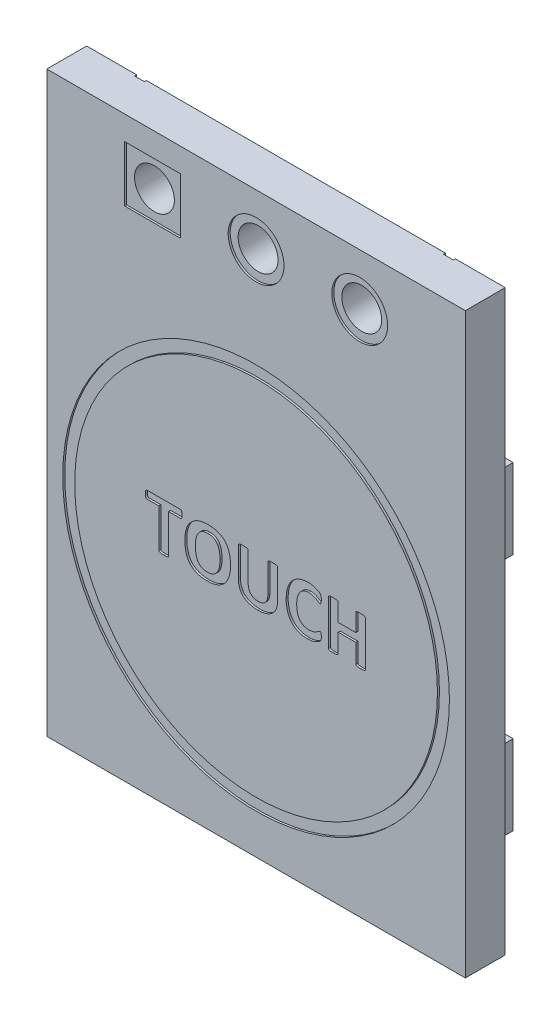
from build123d import *

# Parameters (mm, degrees)
SKETCH_1_W          = 10.5
SKETCH_1_H          = 14.5
SKETCH_1_R          = 0.5
EXTRUDE_1_DEPTH     = 1
SKETCH_2_R          = 4.85
SKETCH_2_R_2        = 4.55
CUT_EXTRUDE_1_DEPTH = 0.05
SKETCH_3_W          = 1.3
SKETCH_3_H          = 2
SKETCH_3_W_2        = 3
EXTRUDE_2_DEPTH     = 1
SKETCH_4_R          = 0.7
SKETCH_4_W          = 1.4
SKETCH_4_H          = 1.4
CUT_EXTRUDE_2_DEPTH = 0.05
CUT_EXTRUDE_3_DEPTH = 0.05
CUT_EXTRUDE_START   = -0.05
SKETCH_6_R          = 0.7
SKETCH_6_W          = 1.4
SKETCH_6_H          = 1.4
CUT_EXTRUDE_4_DEPTH = 0.05


with BuildPart() as part:
    # Эскиз1 → Бобышка-Вытянуть1 (new body)
    with BuildSketch(Plane.XY):
        Rectangle(SKETCH_1_W, SKETCH_1_H)
        with Locations((0, 5.95)):
            Circle(SKETCH_1_R, mode=Mode.SUBTRACT)
        with Locations((2.6, 5.95)):
            Circle(SKETCH_1_R, mode=Mode.SUBTRACT)
        with Locations(Location((-2.6, 5.95, 0), (0, 0, 180))):
            Circle(SKETCH_1_R, mode=Mode.SUBTRACT)
    extrude(amount=EXTRUDE_1_DEPTH)

    # Эскиз2 → Вырез-Вытянуть1 (cut)
    with BuildSketch(Plane.XY.offset(1)):
        with Locations((0, -1.4)):
            Circle(SKETCH_2_R)
        with Locations((0, -1.4)):
            Circle(SKETCH_2_R_2, mode=Mode.SUBTRACT)
    extrude(amount=-CUT_EXTRUDE_1_DEPTH, mode=Mode.SUBTRACT)

    # Эскиз3 → Бобышка-Вытянуть2 (add)
    with BuildSketch(Plane(origin=(0, 0, 0), x_dir=(-1, 0, 0), z_dir=(0, 0, -1))):
        with Locations((3.6, 2.05)):
            Rectangle(SKETCH_3_W, SKETCH_3_H)
        with Locations((0, -4.75)):
            Rectangle(SKETCH_3_W_2, SKETCH_3_H)
        with Locations((-3.8, -4.45)):
            Rectangle(SKETCH_3_W, SKETCH_3_H)
        with Locations((-3.8, 1.55)):
            Rectangle(SKETCH_3_W, SKETCH_3_H)
    extrude(amount=EXTRUDE_2_DEPTH)

    # Эскиз4 → Вырез-Вытянуть2 (cut)
    with BuildSketch(Plane(origin=(0, 0, 0), x_dir=(-1, 0, 0), z_dir=(0, 0, -1))):
        with Locations(Location((0, 5.95, 0), (0, 0, 90))):
            Circle(SKETCH_4_R)
        with Locations(Location((-2.6, 5.95, 0), (0, 0, 90))):
            Circle(SKETCH_4_R)
        with Locations((2.6, 5.95)):
            Rectangle(SKETCH_4_W, SKETCH_4_H)
    extrude(amount=-CUT_EXTRUDE_2_DEPTH, mode=Mode.SUBTRACT)

    # Эскиз5 → Вырез-Вытянуть3 (cut)
    # profile 1 of 10: a face of its own
    with BuildSketch(Plane(origin=(0, 0, 0), x_dir=(-1, 0, 0), z_dir=(0, 0, -1))):
        Polygon((4, 7.25), (4, 4.4), (-4, 4.4), (-4, 7.25), (-3.75, 7.25), (-3.75, 4.65), (3.75, 4.65), (3.75, 7.25), align=None)
    # profile 2 of 10: a face of its own
    with BuildSketch(Plane(origin=(0, 0, 0), x_dir=(-1, 0, 0), z_dir=(0, 0, -1))):
        with BuildLine():
            add(Edge.make_bspline(
                [(2.34765625, 3.238796752), (2.340609981, 3.238888212), (2.327497119, 3.239058417), (2.309407513, 3.240177654), (2.294637773, 3.242858015), (2.28293433, 3.245530114), (2.274316977, 3.249357027), (2.268458077, 3.254176612), (2.265139129, 3.260126788), (2.264852002, 3.264416842), (2.264705882, 3.26660006)],
                knots=[0, 0, 0, 0, 1.779398799, 3.31139939, 4.567095847, 5.566076679, 6.335911413, 6.925285077, 7.453074891, 8, 8, 8, 8], degree=3))
            add(Edge.make_bspline(
                [(2.264705882, 3.26660006), (2.264948198, 3.26852939), (2.265514373, 3.273037296), (2.268314236, 3.280439421), (2.272703986, 3.289304295), (2.278874068, 3.29961539), (2.285987669, 3.311664127), (2.29360845, 3.325599609), (2.301049849, 3.341608907), (2.309170404, 3.359201523), (2.317248482, 3.378681662), (2.324696869, 3.400070578), (2.332070305, 3.423127472), (2.33929764, 3.447946011), (2.345611347, 3.474723543), (2.349909942, 3.503692059), (2.35238392, 3.534632222), (2.352752072, 3.555964315), (2.352941176, 3.566921752)],
                knots=[0, 0, 0, 0, 0.293689548, 0.686209937, 1.189443138, 1.792310494, 2.504556712, 3.309067764, 4.196300198, 5.177446892, 6.24376757, 7.388474631, 8.606423563, 9.90981592, 11.302690418, 12.769350193, 14.340545492, 16, 16, 16, 16], degree=3))
            add(Edge.make_bspline(
                [(2.352941176, 3.566921752), (2.352623551, 3.578807494), (2.352002227, 3.602057788), (2.347396648, 3.636036763), (2.339486808, 3.668176795), (2.328838868, 3.698622254), (2.314740817, 3.726866065), (2.298970627, 3.753625724), (2.279437732, 3.777467268), (2.258164931, 3.799744299), (2.234148968, 3.819506148), (2.207806888, 3.836842702), (2.179085013, 3.851530751), (2.148259406, 3.863953862), (2.115484561, 3.873741817), (2.080917419, 3.880976886), (2.044676921, 3.885067653), (2.019924178, 3.885590192), (2.007352941, 3.885855575)],
                knots=[0, 0, 0, 0, 1.077017183, 2.106807158, 3.10010998, 4.072726939, 5.022687989, 5.957205647, 6.880832328, 7.808623027, 8.745380842, 9.692598978, 10.661219764, 11.664057199, 12.700586205, 13.757006006, 14.860845036, 16, 16, 16, 16], degree=3))
            add(Edge.make_bspline(
                [(2.007352941, 3.885855575), (1.99362916, 3.885631449), (1.966950122, 3.885195747), (1.92815898, 3.880654985), (1.891831678, 3.8737253), (1.858098577, 3.863751693), (1.826919655, 3.851469303), (1.798573346, 3.836348232), (1.77251022, 3.819372754), (1.749298557, 3.799765954), (1.728753852, 3.778081104), (1.710831089, 3.754369016), (1.695626577, 3.728549577), (1.683284192, 3.700678065), (1.673588697, 3.671114434), (1.666776173, 3.640012711), (1.66250893, 3.607404856), (1.662016163, 3.58516437), (1.661764706, 3.573815134)],
                knots=[0, 0, 0, 0, 1.248536176, 2.427154956, 3.549596263, 4.610608544, 5.624209524, 6.594026153, 7.52982316, 8.450067412, 9.352474283, 10.243391269, 11.149640416, 12.073337161, 13.012451872, 13.976513907, 14.967422708, 16, 16, 16, 16], degree=3))
            add(Edge.make_bspline(
                [(1.661764706, 3.573815134), (1.662118, 3.562531809), (1.662826368, 3.539908294), (1.668556785, 3.506559906), (1.677288659, 3.474339865), (1.686601115, 3.454450877), (1.691176471, 3.444679104)],
                knots=[0, 0, 0, 0, 1.012831231, 2.030766797, 3.032484847, 4, 4, 4, 4], degree=3))
            Line((1.691176471, 3.444679104), (1.911764706, 3.444679104))
            Line((1.911764706, 3.444679104), (1.911764706, 3.635625796))
            add(Edge.make_bspline(
                [(1.911764706, 3.635625796), (1.911968843, 3.637902589), (1.912375222, 3.642435045), (1.916315103, 3.648458192), (1.922121984, 3.6536983), (1.93048443, 3.65803304), (1.941601729, 3.661380855), (1.955636943, 3.663800751), (1.972863477, 3.665046783), (1.98536881, 3.665189514), (1.9921875, 3.66526734)],
                knots=[0, 0, 0, 0, 0.580503562, 1.155619503, 1.797861758, 2.58345463, 3.556663884, 4.779377147, 6.243914818, 8, 8, 8, 8], degree=3))
            add(Edge.make_bspline(
                [(1.9921875, 3.66526734), (1.999164726, 3.66523725), (2.01191601, 3.665182258), (2.02930598, 3.663415091), (2.043496502, 3.661469989), (2.054616605, 3.657949887), (2.063134182, 3.653769965), (2.068976359, 3.648452621), (2.072919536, 3.642436388), (2.073325489, 3.637903038), (2.073529412, 3.635625796)],
                knots=[0, 0, 0, 0, 1.778883453, 3.251012578, 4.459076064, 5.423263628, 6.218804493, 6.855093136, 7.42487773, 8, 8, 8, 8], degree=3))
            Line((2.073529412, 3.635625796), (2.073529412, 3.293484252))
            add(Edge.make_bspline(
                [(2.073529412, 3.293484252), (2.073306111, 3.289555521), (2.072873284, 3.281940421), (2.069603815, 3.27115894), (2.064130958, 3.261703521), (2.056697893, 3.253498918), (2.047025639, 3.247063216), (2.035658069, 3.242263897), (2.022524689, 3.239173707), (2.013192666, 3.238926892), (2.008272059, 3.238796752)],
                knots=[0, 0, 0, 0, 0.982011517, 1.903443187, 2.787656502, 3.696447357, 4.647879199, 5.669480075, 6.771158773, 8, 8, 8, 8], degree=3))
            Line((2.008272059, 3.238796752), (1.608685662, 3.238796752))
            add(Edge.make_bspline(
                [(1.608685662, 3.238796752), (1.601383771, 3.23919853), (1.587499432, 3.239962499), (1.570688475, 3.244759797), (1.559422064, 3.251943248), (1.551839127, 3.259299745), (1.545456785, 3.268911483), (1.537947962, 3.285315616), (1.529365497, 3.309988449), (1.518646519, 3.343238306), (1.508862824, 3.380286124), (1.500285317, 3.419361031), (1.493749373, 3.459260218), (1.488894303, 3.499733901), (1.485772033, 3.540447664), (1.485453295, 3.567758749), (1.485294118, 3.581397854)],
                knots=[0, 0, 0, 0, 0.779410862, 1.482027598, 1.830954187, 2.194854883, 2.600373776, 3.053371266, 4.115461934, 5.383780219, 6.7785542, 8.199579033, 9.648428948, 11.088040423, 12.545772806, 14, 14, 14, 14], degree=3))
            add(Edge.make_bspline(
                [(1.485294118, 3.581397854), (1.485654264, 3.6008708), (1.4863568, 3.638856558), (1.492894026, 3.694222267), (1.503675766, 3.746427195), (1.518573939, 3.795543361), (1.537521461, 3.841353707), (1.560740317, 3.883454678), (1.587394504, 3.922152501), (1.618198485, 3.956966867), (1.652488516, 3.98824745), (1.690802605, 4.015131427), (1.732327005, 4.038497719), (1.77742776, 4.057742117), (1.825754609, 4.073302606), (1.877551963, 4.083791347), (1.932331215, 4.090759446), (1.969952746, 4.091406756), (1.989200368, 4.091737928)],
                knots=[0, 0, 0, 0, 1.148924805, 2.241200712, 3.284689811, 4.291389652, 5.266076721, 6.204815913, 7.123988216, 8.033606789, 8.94250619, 9.856874996, 10.789904395, 11.749707613, 12.74615509, 13.780794235, 14.864628056, 16, 16, 16, 16], degree=3))
            add(Edge.make_bspline(
                [(1.989200368, 4.091737928), (2.009133996, 4.091312619), (2.048053594, 4.090482219), (2.104845549, 4.083546636), (2.158354829, 4.071797025), (2.208720665, 4.055745958), (2.255668435, 4.035294359), (2.299054192, 4.010831545), (2.338997987, 3.982726666), (2.374822835, 3.950396598), (2.407062792, 3.914587384), (2.435134804, 3.875044388), (2.459400335, 3.832113875), (2.47935658, 3.785700641), (2.495171914, 3.736218533), (2.506695457, 3.683936668), (2.51338985, 3.628830371), (2.514260443, 3.591220149), (2.514705882, 3.571976899)],
                knots=[0, 0, 0, 0, 1.145759738, 2.237049263, 3.283057264, 4.291298139, 5.271383886, 6.221767555, 7.150355457, 8.07337199, 8.990170157, 9.915169836, 10.855719262, 11.820178955, 12.814495563, 13.838054106, 14.893841544, 16, 16, 16, 16], degree=3))
            add(Edge.make_bspline(
                [(2.514705882, 3.571976899), (2.514647342, 3.561404207), (2.514533156, 3.540781858), (2.51277753, 3.510518099), (2.510429797, 3.481673164), (2.506638982, 3.454339), (2.502307943, 3.428674871), (2.49743723, 3.404622364), (2.492256399, 3.38221661), (2.484825472, 3.355574584), (2.47504024, 3.32635892), (2.463556255, 3.300488112), (2.454243031, 3.283444603), (2.448010569, 3.273255762), (2.442360106, 3.264968937), (2.435219486, 3.256241169), (2.423398264, 3.248128818), (2.408877108, 3.243683537), (2.394686317, 3.24100956), (2.38114545, 3.239830756), (2.365211423, 3.238822477), (2.353786105, 3.238805734), (2.34765625, 3.238796752)],
                knots=[0, 0, 0, 0, 1.504834915, 2.935225369, 4.314286253, 5.623473051, 6.862107551, 8.018953422, 9.116525852, 10.134992674, 11.955575965, 13.49775021, 14.156484999, 14.719361055, 15.197250953, 15.583977948, 16.319132894, 17.194945814, 17.727432017, 18.374053831, 19.127655391, 20, 20, 20, 20], degree=3))
        make_face()
    # profile 3 of 10: a face of its own
    with BuildSketch(Plane(origin=(0, 0, 0), x_dir=(-1, 0, 0), z_dir=(0, 0, -1))):
        with BuildLine():
            add(Edge.make_bspline(
                [(1.572380515, 2.209384987), (1.566758643, 2.209689939), (1.555923306, 2.210277689), (1.540666261, 2.214877879), (1.527898922, 2.222671145), (1.517282486, 2.232489357), (1.509049047, 2.244469078), (1.503697686, 2.258263091), (1.500798284, 2.272990302), (1.500265938, 2.282979397), (1.5, 2.287969546)],
                knots=[0, 0, 0, 0, 1.119587883, 2.157841993, 3.137061224, 4.076806375, 5.021128735, 6.007699032, 7.004726924, 8, 8, 8, 8], degree=3))
            Line((1.5, 2.287969546), (1.5, 2.377123957))
            add(Edge.make_bspline(
                [(1.5, 2.377123957), (1.500238091, 2.385793266), (1.500681689, 2.401945455), (1.504630633, 2.424926476), (1.512891216, 2.445244801), (1.526041098, 2.463462268), (1.543611787, 2.480702826), (1.567006957, 2.496738484), (1.595852845, 2.513395972), (1.617562677, 2.523807306), (1.629365809, 2.529467707)],
                knots=[0, 0, 0, 0, 0.966324417, 1.800403729, 2.585389016, 3.388512048, 4.288246215, 5.316681711, 6.541142035, 8, 8, 8, 8], degree=3))
            Line((1.629365809, 2.529467707), (2.106387868, 2.76269381))
            add(Edge.make_bspline(
                [(2.106387868, 2.76269381), (2.121050443, 2.769682815), (2.151320959, 2.784111438), (2.198280761, 2.804230351), (2.245982857, 2.824149846), (2.278294246, 2.835956179), (2.294117647, 2.841737928)],
                knots=[0, 0, 0, 0, 0.95641289, 1.974490259, 3.00807566, 4, 4, 4, 4], degree=3))
            Line((2.294117647, 2.841737928), (2.294117647, 2.843346384))
            add(Edge.make_bspline(
                [(2.294117647, 2.843346384), (2.275276566, 2.842912884), (2.237674244, 2.842047721), (2.181066641, 2.841654427), (2.123697959, 2.8417597), (2.08509499, 2.841745262), (2.065487132, 2.841737928)],
                knots=[0, 0, 0, 0, 0.989090355, 1.973989423, 2.970915262, 4, 4, 4, 4], degree=3))
            Line((2.065487132, 2.841737928), (1.533777574, 2.841737928))
            add(Edge.make_bspline(
                [(1.533777574, 2.841737928), (1.531303609, 2.841991082), (1.526300865, 2.842502999), (1.518927784, 2.845789664), (1.513109541, 2.852662896), (1.508172555, 2.862271855), (1.504897691, 2.875467747), (1.501706752, 2.892304421), (1.500466456, 2.913799389), (1.50016647, 2.929668735), (1.5, 2.93847506)],
                knots=[0, 0, 0, 0, 0.532944552, 1.077697464, 1.68318278, 2.42657119, 3.384916904, 4.588823808, 6.107046925, 8, 8, 8, 8], degree=3))
            add(Edge.make_bspline(
                [(1.5, 2.93847506), (1.500149744, 2.947132044), (1.500420391, 2.962778713), (1.501852321, 2.983989395), (1.504518563, 3.000699691), (1.5080288, 3.013562571), (1.512711296, 3.022886132), (1.51869207, 3.029041839), (1.525633215, 3.032490235), (1.530602032, 3.032772943), (1.533088235, 3.032914399)],
                knots=[0, 0, 0, 0, 1.898594668, 3.43152817, 4.657506865, 5.603455172, 6.347416424, 6.917484938, 7.458351575, 8, 8, 8, 8], degree=3))
            Line((1.533088235, 3.032914399), (2.427619485, 3.032914399))
            add(Edge.make_bspline(
                [(2.427619485, 3.032914399), (2.433313222, 3.03267848), (2.444105593, 3.032231301), (2.459271335, 3.028109187), (2.472013493, 3.02081453), (2.482254236, 3.010863725), (2.490290384, 2.999200064), (2.495813869, 2.985947068), (2.499401643, 2.971599612), (2.499797128, 2.961551988), (2.5, 2.956397854)],
                knots=[0, 0, 0, 0, 1.147549194, 2.17515806, 3.137577991, 4.077772196, 5.033841095, 5.975558705, 6.961521558, 8, 8, 8, 8], degree=3))
            Line((2.5, 2.956397854), (2.5, 2.842886825))
            add(Edge.make_bspline(
                [(2.5, 2.842886825), (2.499871327, 2.833522599), (2.499633682, 2.81622793), (2.495654926, 2.792281803), (2.489296162, 2.771467414), (2.478759985, 2.753364484), (2.464535715, 2.736837459), (2.445839316, 2.721876288), (2.422749529, 2.707605009), (2.405418689, 2.699186434), (2.396139706, 2.694679104)],
                knots=[0, 0, 0, 0, 1.148439133, 2.121037438, 2.971705988, 3.805834735, 4.672982658, 5.635202017, 6.733880186, 8, 8, 8, 8], degree=3))
            Line((2.396139706, 2.694679104), (2.032398897, 2.51292359))
            add(Edge.make_bspline(
                [(2.032398897, 2.51292359), (2.02143996, 2.507651298), (1.999738534, 2.497210846), (1.9675238, 2.48143954), (1.935522028, 2.466238893), (1.903698204, 2.451610254), (1.87214961, 2.437439981), (1.841204628, 2.423233329), (1.810186702, 2.41001746), (1.789670077, 2.401109292), (1.779411765, 2.396655207)],
                knots=[0, 0, 0, 0, 1.048149469, 2.075597171, 3.091378283, 4.101566792, 5.094261913, 6.072207032, 7.036103516, 8, 8, 8, 8], degree=3))
            add(Edge.make_bspline(
                [(1.779411765, 2.396655207), (1.797639078, 2.396713998), (1.834851547, 2.398241361), (1.891081081, 2.399437717), (1.9471469, 2.40048168), (1.98422131, 2.400535309), (2.002297794, 2.400561457)],
                knots=[0, 0, 0, 0, 0.981864332, 2.004551901, 3.027073275, 4, 4, 4, 4], degree=3))
            Line((2.002297794, 2.400561457), (2.467141544, 2.400561457))
            add(Edge.make_bspline(
                [(2.467141544, 2.400561457), (2.469565813, 2.400357277), (2.474479851, 2.399943399), (2.481314415, 2.395782012), (2.487195764, 2.388890811), (2.492204699, 2.378924392), (2.495997129, 2.36554641), (2.49825142, 2.348388552), (2.49990307, 2.32691126), (2.499965409, 2.311028755), (2.5, 2.302215869)],
                knots=[0, 0, 0, 0, 0.513514522, 1.040903369, 1.654763982, 2.430140109, 3.402872071, 4.610164628, 6.119047709, 8, 8, 8, 8], degree=3))
            add(Edge.make_bspline(
                [(2.5, 2.302215869), (2.499957871, 2.293786684), (2.499880794, 2.278364819), (2.498262879, 2.257491988), (2.496042263, 2.240869292), (2.49231614, 2.228232857), (2.487070411, 2.219321946), (2.481285359, 2.213098985), (2.474248988, 2.209826438), (2.469392853, 2.209534264), (2.466911765, 2.209384987)],
                knots=[0, 0, 0, 0, 1.871394417, 3.423864974, 4.645973776, 5.592737433, 6.324952366, 6.926341917, 7.45144833, 8, 8, 8, 8], degree=3))
            Line((2.466911765, 2.209384987), (1.572380515, 2.209384987))
        make_face()
    # profile 4 of 10: a face of its own
    with BuildSketch(Plane(origin=(0, 0, 0), x_dir=(-1, 0, 0), z_dir=(0, 0, -1))):
        with BuildLine():
            add(Edge.make_bspline(
                [(2.014705882, 1.150561457), (1.992550139, 1.150961859), (1.949808765, 1.151734287), (1.888252917, 1.158761498), (1.831578278, 1.169786403), (1.779778454, 1.18558366), (1.732901023, 1.205962741), (1.690340641, 1.22988531), (1.652381432, 1.258025092), (1.619091397, 1.290339349), (1.589782807, 1.326142885), (1.565299551, 1.366055355), (1.54442441, 1.409267452), (1.527857165, 1.456453927), (1.515342337, 1.507735287), (1.506560531, 1.563459364), (1.500944626, 1.623715694), (1.500322113, 1.665483873), (1.5, 1.687096384)],
                knots=[0, 0, 0, 0, 1.243195588, 2.398289499, 3.472438518, 4.480099057, 5.431298172, 6.336213933, 7.214965272, 8.075406065, 8.934169752, 9.8050299, 10.69723392, 11.623227574, 12.606491238, 13.656063147, 14.787154231, 16, 16, 16, 16], degree=3))
            Line((1.5, 1.687096384), (1.5, 1.927905207))
            add(Edge.make_bspline(
                [(1.5, 1.927905207), (1.50016583, 1.932055844), (1.500486158, 1.940073501), (1.503278734, 1.951656552), (1.508221308, 1.962000372), (1.514691584, 1.971512439), (1.523557206, 1.979584887), (1.535159392, 1.98499196), (1.548922108, 1.988221739), (1.558803106, 1.988595871), (1.564108456, 1.988796752)],
                knots=[0, 0, 0, 0, 0.990179711, 1.912700015, 2.820789353, 3.713653051, 4.646088367, 5.643837726, 6.734918842, 8, 8, 8, 8], degree=3))
            Line((1.564108456, 1.988796752), (2.435891544, 1.988796752))
            add(Edge.make_bspline(
                [(2.435891544, 1.988796752), (2.441195266, 1.988591746), (2.451073234, 1.988209932), (2.46478839, 1.985045855), (2.476269535, 1.979524595), (2.48505467, 1.971445467), (2.491812673, 1.962077606), (2.49670682, 1.95164653), (2.499517789, 1.94007624), (2.499835517, 1.932056778), (2.5, 1.927905207)],
                knots=[0, 0, 0, 0, 1.265995626, 2.357865433, 3.339934658, 4.273043988, 5.177171631, 6.085917384, 7.009104535, 8, 8, 8, 8], degree=3))
            Line((2.5, 1.927905207), (2.5, 1.66917359))
            add(Edge.make_bspline(
                [(2.5, 1.66917359), (2.499724844, 1.647557075), (2.499194836, 1.605919092), (2.493000253, 1.546040344), (2.483738301, 1.491057972), (2.469849783, 1.441074623), (2.452262907, 1.395406927), (2.430907228, 1.353697425), (2.405734993, 1.315590574), (2.376543313, 1.281539595), (2.344093036, 1.25075864), (2.307293372, 1.224703245), (2.267471681, 1.201625808), (2.223698421, 1.183198667), (2.176594086, 1.168281314), (2.125717029, 1.158281458), (2.071410546, 1.151574276), (2.033952428, 1.150905225), (2.014705882, 1.150561457)],
                knots=[0, 0, 0, 0, 1.277119296, 2.460002067, 3.554068866, 4.56891834, 5.520573265, 6.44178675, 7.333232203, 8.213143003, 9.087504839, 9.969509283, 10.871842518, 11.802704797, 12.770587621, 13.787142021, 14.863000174, 16, 16, 16, 16], degree=3))
        make_face()
        with BuildLine():
            add(Edge.make_bspline(
                [(2.006893382, 1.35644381), (2.018466177, 1.356676154), (2.04127373, 1.357134054), (2.074824502, 1.36040147), (2.107132965, 1.365712228), (2.138195666, 1.372867807), (2.16755301, 1.382787535), (2.195198379, 1.394860521), (2.220493584, 1.409971113), (2.243984592, 1.427261236), (2.265253667, 1.447296801), (2.283940067, 1.470329771), (2.300323575, 1.495864086), (2.314052492, 1.524472361), (2.325296824, 1.556598695), (2.332826938, 1.593128803), (2.337386667, 1.634130931), (2.33794257, 1.662956288), (2.338235294, 1.678134987)],
                knots=[0, 0, 0, 0, 1.049626046, 2.068592971, 3.054261278, 4.018143076, 4.956242261, 5.86126734, 6.748926599, 7.622914204, 8.502599006, 9.391263619, 10.306681874, 11.248170676, 12.263246045, 13.386056063, 14.623563693, 16, 16, 16, 16], degree=3))
            Line((2.338235294, 1.678134987), (2.338235294, 1.782914399))
            Line((2.338235294, 1.782914399), (1.661764706, 1.782914399))
            Line((1.661764706, 1.782914399), (1.661764706, 1.674918075))
            add(Edge.make_bspline(
                [(1.661764706, 1.674918075), (1.662030887, 1.661275176), (1.662543489, 1.635002236), (1.666386593, 1.59725102), (1.672922256, 1.562826313), (1.682341693, 1.531672635), (1.694658872, 1.503463186), (1.709718668, 1.477859592), (1.727167473, 1.454298196), (1.747919856, 1.433670653), (1.770903931, 1.414987229), (1.797051684, 1.399551293), (1.825332846, 1.385709211), (1.856609576, 1.375179198), (1.890376649, 1.366515536), (1.926854262, 1.360833825), (1.965985623, 1.356960487), (1.992942983, 1.356620008), (2.006893382, 1.35644381)],
                knots=[0, 0, 0, 0, 1.212284114, 2.334567395, 3.367799545, 4.321639246, 5.220796268, 6.096353087, 6.956723451, 7.818277712, 8.689963065, 9.5818251, 10.510387323, 11.483391085, 12.508587825, 13.605230326, 14.760709728, 16, 16, 16, 16], degree=3))
        make_face(mode=Mode.SUBTRACT)
    # profile 5 of 10: a face of its own
    with BuildSketch(Plane(origin=(0, 0, 0), x_dir=(-1, 0, 0), z_dir=(0, 0, -1))):
        with BuildLine():
            add(Edge.make_bspline(
                [(-0.467830882, 3.841737928), (-0.470241518, 3.842053305), (-0.475180796, 3.842699496), (-0.482271785, 3.846594168), (-0.487905571, 3.853976771), (-0.492491042, 3.864401612), (-0.495214484, 3.878511456), (-0.498252913, 3.896312045), (-0.499542142, 3.918853407), (-0.499837072, 3.935489061), (-0.5, 3.944679104)],
                knots=[0, 0, 0, 0, 0.498707244, 1.021827348, 1.616370009, 2.379739004, 3.352847354, 4.568078665, 6.104101783, 8, 8, 8, 8], degree=3))
            add(Edge.make_bspline(
                [(-0.5, 3.944679104), (-0.499839081, 3.953716885), (-0.499545581, 3.970200941), (-0.498205361, 3.992730319), (-0.4952636, 4.010705641), (-0.492481128, 4.024942612), (-0.487923497, 4.035416619), (-0.482201103, 4.042699194), (-0.475271681, 4.046992431), (-0.470254173, 4.047415805), (-0.467830882, 4.047620281)],
                knots=[0, 0, 0, 0, 1.863228801, 3.398353026, 4.644066529, 5.616605408, 6.379527673, 6.973722403, 7.504341763, 8, 8, 8, 8], degree=3))
            Line((-0.467830882, 4.047620281), (0.467830882, 4.047620281))
            add(Edge.make_bspline(
                [(0.467830882, 4.047620281), (0.470340081, 4.047439599), (0.47538702, 4.047076179), (0.482287059, 4.042595474), (0.487957555, 4.035210824), (0.49207086, 4.024443504), (0.495400615, 4.010380844), (0.498085896, 3.992476081), (0.499947445, 3.970146098), (0.499981339, 3.95372194), (0.5, 3.944679104)],
                knots=[0, 0, 0, 0, 0.51152551, 1.028869507, 1.635637596, 2.407100011, 3.38387667, 4.614658833, 6.136094318, 8, 8, 8, 8], degree=3))
            add(Edge.make_bspline(
                [(0.5, 3.944679104), (0.499978791, 3.935483844), (0.499940383, 3.918831546), (0.498130205, 3.896338667), (0.495363446, 3.878450709), (0.492117503, 3.864509401), (0.487958255, 3.85391228), (0.482282621, 3.846687837), (0.475300152, 3.84260897), (0.470328531, 3.842029196), (0.467830882, 3.841737928)],
                knots=[0, 0, 0, 0, 1.895582807, 3.432834476, 4.648074481, 5.624899837, 6.381875126, 6.976422041, 7.485773875, 8, 8, 8, 8], degree=3))
            Line((0.467830882, 3.841737928), (-0.467830882, 3.841737928))
        make_face()
    # profile 6 of 10: a face of its own
    with BuildSketch(Plane(origin=(0, 0, 0), x_dir=(-1, 0, 0), z_dir=(0, 0, -1))):
        with BuildLine():
            add(Edge.make_bspline(
                [(-0.701286765, 3.532914399), (-0.70440838, 3.53433037), (-0.710266532, 3.536987641), (-0.718063896, 3.542756609), (-0.723663294, 3.550977952), (-0.728317453, 3.561195726), (-0.731210439, 3.574181087), (-0.733929401, 3.589948684), (-0.735052579, 3.60949446), (-0.735208388, 3.623831198), (-0.735294118, 3.631719546)],
                knots=[0, 0, 0, 0, 0.737752819, 1.384497422, 2.057633702, 2.854953043, 3.791201774, 4.911274809, 6.30052429, 8, 8, 8, 8], degree=3))
            add(Edge.make_bspline(
                [(-0.735294118, 3.631719546), (-0.73521255, 3.641452465), (-0.735065814, 3.658961414), (-0.732926246, 3.682513446), (-0.729231657, 3.700834948), (-0.724011834, 3.714424741), (-0.716713467, 3.723841472), (-0.70675888, 3.727857257), (-0.695700643, 3.727447731), (-0.6882992, 3.725271642), (-0.684283088, 3.724090869)],
                knots=[0, 0, 0, 0, 1.816358663, 3.267522501, 4.408951004, 5.293236442, 5.972506597, 6.562030223, 7.219740436, 8, 8, 8, 8], degree=3))
            Line((-0.684283088, 3.724090869), (0.612362132, 3.253502634))
            add(Edge.make_bspline(
                [(0.612362132, 3.253502634), (0.615508041, 3.25235869), (0.621549226, 3.250161938), (0.629216456, 3.244266221), (0.635575009, 3.236622266), (0.639701331, 3.226169892), (0.64325898, 3.213257746), (0.645193696, 3.197015343), (0.646969823, 3.177331959), (0.647027441, 3.162976144), (0.647058824, 3.155157046)],
                knots=[0, 0, 0, 0, 0.714359537, 1.371806707, 2.049487737, 2.822162994, 3.759169376, 4.921382755, 6.323187471, 8, 8, 8, 8], degree=3))
            add(Edge.make_bspline(
                [(0.647058824, 3.155157046), (0.647029801, 3.145189339), (0.646978104, 3.12743377), (0.644357254, 3.103859501), (0.64101819, 3.08572992), (0.635801079, 3.072371717), (0.628343568, 3.063329227), (0.618588862, 3.058918074), (0.607509153, 3.059548041), (0.600069586, 3.06135132), (0.596047794, 3.062326163)],
                knots=[0, 0, 0, 0, 1.861834867, 3.316503668, 4.428524347, 5.300865138, 5.970298383, 6.566346717, 7.224974473, 8, 8, 8, 8], degree=3))
            Line((0.596047794, 3.062326163), (-0.701286765, 3.532914399))
        make_face()
    # profile 7 of 10: a face of its own
    with BuildSketch(Plane(origin=(0, 0, 0), x_dir=(-1, 0, 0), z_dir=(0, 0, -1))):
        with BuildLine():
            add(Edge.make_bspline(
                [(0.011488971, 2.032914399), (-0.008590408, 2.033338668), (-0.047761288, 2.034166334), (-0.104879772, 2.039805762), (-0.158693836, 2.049813814), (-0.209297781, 2.063137088), (-0.256442772, 2.080602245), (-0.299850733, 2.102053684), (-0.339717051, 2.127164591), (-0.37572769, 2.156240985), (-0.407891695, 2.189086577), (-0.436048215, 2.225561118), (-0.460127644, 2.265757697), (-0.480157835, 2.309574972), (-0.495788479, 2.357122027), (-0.50666105, 2.408278756), (-0.513432347, 2.46288011), (-0.514273699, 2.500495025), (-0.514705882, 2.519816972)],
                knots=[0, 0, 0, 0, 1.181233459, 2.304351873, 3.371947617, 4.39826701, 5.3791809, 6.324264344, 7.241792078, 8.145350426, 9.040703723, 9.940163258, 10.849690114, 11.791286947, 12.768758951, 13.787772497, 14.863627853, 16, 16, 16, 16], degree=3))
            add(Edge.make_bspline(
                [(-0.514705882, 2.519816972), (-0.51440012, 2.538828713), (-0.513806817, 2.575719292), (-0.507891634, 2.629181556), (-0.498721678, 2.678988252), (-0.485380178, 2.725045593), (-0.468156662, 2.767397046), (-0.446921294, 2.806065168), (-0.421740383, 2.841150856), (-0.392201171, 2.872383734), (-0.35875127, 2.90019929), (-0.32080992, 2.923844824), (-0.27900194, 2.944275794), (-0.23263957, 2.960372087), (-0.182218919, 2.973230584), (-0.127412736, 2.98228377), (-0.068282974, 2.987832368), (-0.027356608, 2.988468151), (-0.006204044, 2.988796752)],
                knots=[0, 0, 0, 0, 1.146166388, 2.224033198, 3.239603498, 4.19707874, 5.110637026, 5.991361923, 6.851607032, 7.707774656, 8.577185544, 9.467848022, 10.397508704, 11.377842912, 12.422004822, 13.532246611, 14.72455543, 16, 16, 16, 16], degree=3))
            add(Edge.make_bspline(
                [(-0.006204044, 2.988796752), (0.013421814, 2.988507127), (0.051774095, 2.987941151), (0.107664048, 2.981688191), (0.16061625, 2.972315421), (0.210315766, 2.958409505), (0.256965503, 2.941078764), (0.300052516, 2.919720461), (0.339530365, 2.894476464), (0.375291382, 2.865406621), (0.407429946, 2.832625614), (0.435656502, 2.79611492), (0.459620865, 2.755766982), (0.479610087, 2.711929078), (0.495640419, 2.664475295), (0.506683124, 2.613297498), (0.513442593, 2.558447881), (0.51427609, 2.520679882), (0.514705882, 2.50120484)],
                knots=[0, 0, 0, 0, 1.160742572, 2.268289337, 3.323413741, 4.339376884, 5.317477958, 6.263969784, 7.179163288, 8.084428609, 8.984962506, 9.889626401, 10.808302956, 11.755347959, 12.735609472, 13.765915531, 14.84799589, 16, 16, 16, 16], degree=3))
            add(Edge.make_bspline(
                [(0.514705882, 2.50120484), (0.514402086, 2.482575695), (0.513812934, 2.446448275), (0.507854944, 2.39390625), (0.498638556, 2.3447549), (0.485593936, 2.298901857), (0.468549725, 2.2565857), (0.447649238, 2.217657626), (0.422414377, 2.182423464), (0.393000865, 2.150985237), (0.359547294, 2.123173016), (0.322113949, 2.099010324), (0.280579134, 2.078415124), (0.234845299, 2.061776558), (0.185012932, 2.048642597), (0.130920647, 2.039760767), (0.072667317, 2.033786185), (0.032338545, 2.033211503), (0.011488971, 2.032914399)],
                knots=[0, 0, 0, 0, 1.132297744, 2.19586009, 3.210614101, 4.17017675, 5.089475104, 5.97928108, 6.850365169, 7.716955887, 8.58991781, 9.488986787, 10.419971928, 11.402760547, 12.443138575, 13.548716153, 14.732710582, 16, 16, 16, 16], degree=3))
        make_face()
        with BuildLine():
            add(Edge.make_bspline(
                [(0.000459559, 2.253502634), (0.013406898, 2.253614304), (0.038710508, 2.253832547), (0.075753887, 2.256136517), (0.110925841, 2.26011606), (0.144311584, 2.265131364), (0.175649717, 2.272530415), (0.204799975, 2.281745262), (0.231521135, 2.293426432), (0.256025611, 2.306853264), (0.278091947, 2.32283201), (0.297602026, 2.341294105), (0.314156042, 2.362478011), (0.328458006, 2.385857932), (0.339517924, 2.412269118), (0.347529979, 2.441518323), (0.352046738, 2.473874582), (0.352634536, 2.496365316), (0.352941176, 2.508098222)],
                knots=[0, 0, 0, 0, 1.248284162, 2.439581939, 3.57646079, 4.660692936, 5.692499406, 6.678075816, 7.604166823, 8.500084251, 9.367200805, 10.223876271, 11.080838181, 11.952221325, 12.858909996, 13.831787445, 14.868892633, 16, 16, 16, 16], degree=3))
            add(Edge.make_bspline(
                [(0.352941176, 2.508098222), (0.352598343, 2.519990419), (0.351939939, 2.54282909), (0.34665879, 2.575595678), (0.337726548, 2.605297256), (0.325209617, 2.632018384), (0.309532282, 2.655765171), (0.291858787, 2.677403318), (0.271391085, 2.696301896), (0.248765568, 2.712878024), (0.223978108, 2.727251394), (0.197036051, 2.739086341), (0.168129332, 2.748827391), (0.137374989, 2.755942277), (0.105286138, 2.761419368), (0.072140744, 2.765200641), (0.03811296, 2.767953204), (0.015094599, 2.768122731), (0.003446691, 2.768208516)],
                knots=[0, 0, 0, 0, 1.153283464, 2.214852352, 3.209144116, 4.15318738, 5.066220202, 5.963392081, 6.857172692, 7.760783466, 8.679693563, 9.631077684, 10.61093758, 11.634642483, 12.690108401, 13.767552338, 14.870321563, 16, 16, 16, 16], degree=3))
            add(Edge.make_bspline(
                [(0.003446691, 2.768208516), (-0.009960487, 2.768099363), (-0.036106515, 2.767886497), (-0.074216794, 2.765566784), (-0.110264213, 2.761695277), (-0.144176843, 2.756223115), (-0.175969799, 2.749285869), (-0.205468669, 2.740088849), (-0.232495597, 2.728583485), (-0.257344299, 2.715377713), (-0.279530719, 2.699572049), (-0.298899977, 2.681176404), (-0.315365911, 2.660111955), (-0.329403632, 2.636797736), (-0.33998423, 2.610326519), (-0.347461337, 2.580898266), (-0.352071692, 2.548300212), (-0.352643188, 2.525500898), (-0.352941176, 2.513612928)],
                knots=[0, 0, 0, 0, 1.279679538, 2.49556889, 3.642896623, 4.739116128, 5.77323068, 6.746743089, 7.683741469, 8.573599826, 9.427780593, 10.275900703, 11.114034936, 11.972958761, 12.864977117, 13.824357256, 14.865580979, 16, 16, 16, 16], degree=3))
            add(Edge.make_bspline(
                [(-0.352941176, 2.513612928), (-0.352606972, 2.501718454), (-0.351965139, 2.478875411), (-0.346561285, 2.446088134), (-0.338009292, 2.416266133), (-0.325686024, 2.389418989), (-0.310048117, 2.365744325), (-0.292234159, 2.344222659), (-0.271610387, 2.325408792), (-0.248715682, 2.308778705), (-0.223612384, 2.294458441), (-0.196182106, 2.282917669), (-0.167095514, 2.272841127), (-0.135915953, 2.265762839), (-0.103372928, 2.260271545), (-0.069611013, 2.256514637), (-0.034895327, 2.253757343), (-0.01141808, 2.253588205), (0.000459559, 2.253502634)],
                knots=[0, 0, 0, 0, 1.144038368, 2.197097374, 3.188363945, 4.121730304, 5.027443957, 5.911758703, 6.803781373, 7.706099283, 8.630428182, 9.57797775, 10.566307554, 11.588977022, 12.650515107, 13.741285723, 14.857268412, 16, 16, 16, 16], degree=3))
        make_face(mode=Mode.SUBTRACT)
    # profile 8 of 10: a face of its own
    with BuildSketch(Plane(origin=(0, 0, 0), x_dir=(-1, 0, 0), z_dir=(0, 0, -1))):
        with BuildLine():
            add(Edge.make_bspline(
                [(-2.460248162, 3.544403369), (-2.464193812, 3.545821409), (-2.471499275, 3.548446943), (-2.481631508, 3.554021133), (-2.48919402, 3.56310189), (-2.494446948, 3.575825214), (-2.497564362, 3.592825549), (-2.498847723, 3.610018775), (-2.49931148, 3.626587735), (-2.4998462, 3.641443222), (-2.500045932, 3.658143716), (-2.500015899, 3.669862952), (-2.5, 3.676066972)],
                knots=[0, 0, 0, 0, 0.844408057, 1.563441047, 2.295734498, 3.172174565, 4.305821613, 5.759988913, 6.639135718, 7.641529153, 8.751454454, 10, 10, 10, 10], degree=3))
            add(Edge.make_bspline(
                [(-2.5, 3.676066972), (-2.500014678, 3.685717729), (-2.500041822, 3.703564328), (-2.499870672, 3.728307845), (-2.499299869, 3.749083101), (-2.497968409, 3.76642569), (-2.495960177, 3.780547294), (-2.493492685, 3.792151276), (-2.490063198, 3.801438941), (-2.485836872, 3.809057308), (-2.480872994, 3.815251407), (-2.474280158, 3.819597863), (-2.466580221, 3.822915765), (-2.460952257, 3.824850946), (-2.457950368, 3.825883149)],
                knots=[0, 0, 0, 0, 2.065590314, 3.819779327, 5.296020431, 6.513125995, 7.540180458, 8.34747035, 9.047804135, 9.64969616, 10.208041169, 10.726451495, 11.320704417, 12, 12, 12, 12], degree=3))
            Line((-2.457950368, 3.825883149), (-1.579733456, 4.128502634))
            add(Edge.make_bspline(
                [(-1.579733456, 4.128502634), (-1.575370248, 4.129887675), (-1.567126649, 4.132504494), (-1.555550415, 4.136071448), (-1.545323239, 4.138361034), (-1.536512461, 4.139886073), (-1.528841891, 4.140248884), (-1.522073223, 4.139206025), (-1.516385073, 4.136301986), (-1.511569403, 4.131988939), (-1.507883272, 4.125997586), (-1.505192485, 4.118396366), (-1.503207915, 4.109203302), (-1.501896807, 4.098201025), (-1.501075624, 4.085236347), (-1.500305741, 4.06999406), (-1.500258019, 4.052444688), (-1.500089114, 4.039960601), (-1.5, 4.033373957)],
                knots=[0, 0, 0, 0, 1.276573251, 2.411885467, 3.37553279, 4.197132145, 4.902218777, 5.509658926, 6.082712836, 6.657356358, 7.291251154, 8.021129793, 8.896744583, 9.908644138, 11.107652844, 12.518634463, 14.163220425, 16, 16, 16, 16], degree=3))
            add(Edge.make_bspline(
                [(-1.5, 4.033373957), (-1.499949771, 4.027705256), (-1.4998554, 4.017054933), (-1.500472431, 4.002047578), (-1.500823171, 3.988942068), (-1.501681467, 3.974824021), (-1.503184358, 3.960545133), (-1.50605659, 3.946759663), (-1.51089151, 3.936616467), (-1.518293726, 3.930153515), (-1.527413771, 3.92618903), (-1.533917513, 3.923877318), (-1.537454044, 3.922620281)],
                knots=[0, 0, 0, 0, 1.326988102, 2.493137391, 3.515905883, 4.396232495, 5.804229884, 6.874172063, 7.684305974, 8.382744359, 9.120587064, 10, 10, 10, 10], degree=3))
            Line((-1.537454044, 3.922620281), (-2.301700368, 3.673309619))
            Line((-2.301700368, 3.673309619), (-1.541360294, 3.437326163))
            add(Edge.make_bspline(
                [(-1.541360294, 3.437326163), (-1.537345086, 3.436205293), (-1.530061736, 3.4341721), (-1.520197014, 3.429829063), (-1.512147647, 3.423028103), (-1.506801336, 3.412381368), (-1.502884164, 3.397987133), (-1.501753041, 3.383040466), (-1.500803341, 3.36840321), (-1.500475823, 3.35483418), (-1.499856856, 3.339291689), (-1.499950557, 3.328258396), (-1.5, 3.322436457)],
                knots=[0, 0, 0, 0, 0.926766729, 1.681100195, 2.38137408, 3.220216627, 4.282507745, 5.687709371, 6.540956644, 7.546558277, 8.705392344, 10, 10, 10, 10], degree=3))
            add(Edge.make_bspline(
                [(-1.5, 3.322436457), (-1.500100073, 3.31676972), (-1.500289403, 3.306048746), (-1.500200975, 3.290935061), (-1.501395479, 3.277860599), (-1.502039336, 3.26669723), (-1.503644894, 3.257368973), (-1.505891455, 3.249595553), (-1.508953794, 3.243237551), (-1.514684386, 3.237206016), (-1.524858627, 3.232778731), (-1.54013391, 3.233665907), (-1.559045763, 3.238700384), (-1.573099163, 3.243444622), (-1.581112132, 3.246149693)],
                knots=[0, 0, 0, 0, 1.30001791, 2.459520558, 3.463256689, 4.3093572, 5.022683592, 5.628399378, 6.162654668, 6.62240627, 7.510672863, 8.599777618, 10.061260599, 12, 12, 12, 12], degree=3))
            Line((-1.581112132, 3.246149693), (-2.460248162, 3.544403369))
        make_face()
    # profile 9 of 10: a face of its own
    with BuildSketch(Plane(origin=(0, 0, 0), x_dir=(-1, 0, 0), z_dir=(0, 0, -1))):
        with BuildLine():
            add(Edge.make_bspline(
                [(-2.333869485, 2.41526734), (-2.339692734, 2.415275461), (-2.350428913, 2.415290434), (-2.365297059, 2.416280171), (-2.377828731, 2.417524869), (-2.388387271, 2.419565926), (-2.397305077, 2.422381344), (-2.405490594, 2.425917471), (-2.413402678, 2.431672531), (-2.421204987, 2.437149608), (-2.428131284, 2.443881206), (-2.434354397, 2.451160418), (-2.441378318, 2.460306945), (-2.452354076, 2.475647646), (-2.465572307, 2.49909392), (-2.481212875, 2.531153381), (-2.494456556, 2.568711539), (-2.505868614, 2.610909515), (-2.513345642, 2.657735322), (-2.514242812, 2.690437771), (-2.514705882, 2.707316972)],
                knots=[0, 0, 0, 0, 0.817409155, 1.507037124, 2.091351391, 2.584885869, 3.013447773, 3.403287412, 3.829820449, 4.382603503, 4.740098075, 5.182209427, 5.726452742, 6.359048628, 7.829107965, 9.498266932, 11.362544405, 13.410328885, 15.631064777, 18, 18, 18, 18], degree=3))
            add(Edge.make_bspline(
                [(-2.514705882, 2.707316972), (-2.51428379, 2.7239531), (-2.513458407, 2.756484257), (-2.50773785, 2.804050931), (-2.497844181, 2.84905734), (-2.484076826, 2.891503351), (-2.466427296, 2.931306058), (-2.444472151, 2.967938644), (-2.418763502, 3.00158726), (-2.389180742, 3.03208536), (-2.355568022, 3.059401761), (-2.317963716, 3.083253798), (-2.276527802, 3.103801297), (-2.231229687, 3.120727402), (-2.182129231, 3.134346382), (-2.129129006, 3.1437955), (-2.072359692, 3.149648784), (-2.033256413, 3.150250997), (-2.013097426, 3.150561457)],
                knots=[0, 0, 0, 0, 1.048898634, 2.051071494, 3.015445474, 3.95012188, 4.860232668, 5.75474354, 6.636649859, 7.524644452, 8.427499351, 9.36128947, 10.326727027, 11.338523746, 12.405937675, 13.535086757, 14.729258665, 16, 16, 16, 16], degree=3))
            add(Edge.make_bspline(
                [(-2.013097426, 3.150561457), (-1.992474458, 3.150213678), (-1.952347655, 3.149536993), (-1.893969786, 3.142872155), (-1.839077216, 3.132587795), (-1.787938, 3.117496261), (-1.740439215, 3.098984507), (-1.696853295, 3.076822302), (-1.656918105, 3.051636046), (-1.621476625, 3.022415618), (-1.589771792, 2.990347736), (-1.561941612, 2.955231121), (-1.538435507, 2.916849093), (-1.519176891, 2.875566362), (-1.503910516, 2.831771324), (-1.493311096, 2.785609378), (-1.486285928, 2.737327094), (-1.485628887, 2.704355376), (-1.485294118, 2.687555943)],
                knots=[0, 0, 0, 0, 1.247488915, 2.427281123, 3.550805171, 4.622953559, 5.648903625, 6.631428415, 7.577722604, 8.499965247, 9.404545214, 10.302139903, 11.205174899, 12.121634227, 13.053885424, 14.00612014, 14.984097524, 16, 16, 16, 16], degree=3))
            add(Edge.make_bspline(
                [(-1.485294118, 2.687555943), (-1.485647524, 2.673904227), (-1.486343151, 2.647032908), (-1.491808578, 2.607757302), (-1.500064073, 2.57079251), (-1.510328989, 2.536523191), (-1.522476598, 2.505281147), (-1.534258191, 2.481771603), (-1.543901766, 2.465178927), (-1.550525946, 2.455016447), (-1.556725596, 2.446845891), (-1.563941046, 2.439142659), (-1.571614381, 2.432101988), (-1.580181598, 2.425907962), (-1.589248863, 2.422190574), (-1.599470457, 2.419625165), (-1.611682858, 2.417511086), (-1.626052829, 2.416288826), (-1.643214951, 2.415278616), (-1.655635064, 2.415271336), (-1.662454044, 2.41526734)],
                knots=[0, 0, 0, 0, 1.992374698, 3.921685737, 5.777330327, 7.517748816, 9.139460952, 10.664664016, 11.351231936, 11.940483538, 12.434765898, 12.846220727, 13.479550656, 13.954087228, 14.379878577, 14.90064456, 15.490744311, 16.187256458, 17.004754435, 18, 18, 18, 18], degree=3))
            add(Edge.make_bspline(
                [(-1.662454044, 2.41526734), (-1.669804055, 2.415410854), (-1.683361848, 2.41567558), (-1.70207052, 2.41617601), (-1.717335484, 2.418587593), (-1.729583537, 2.421429015), (-1.738527825, 2.426017702), (-1.745306694, 2.430778653), (-1.749318575, 2.437029696), (-1.749778278, 2.441570086), (-1.75, 2.443759987)],
                knots=[0, 0, 0, 0, 1.772474322, 3.269497114, 4.501713792, 5.495775834, 6.280023247, 6.911427383, 7.474964399, 8, 8, 8, 8], degree=3))
            add(Edge.make_bspline(
                [(-1.75, 2.443759987), (-1.749781355, 2.445847976), (-1.74930675, 2.450380312), (-1.746504192, 2.45732672), (-1.742291554, 2.46505125), (-1.733550337, 2.476818622), (-1.72073387, 2.494444933), (-1.704687508, 2.519822296), (-1.688692691, 2.550587757), (-1.6770055, 2.580104218), (-1.669145228, 2.606510591), (-1.66476547, 2.628804995), (-1.662316021, 2.652957112), (-1.661952631, 2.66970416), (-1.661764706, 2.678364766)],
                knots=[0, 0, 0, 0, 0.294650313, 0.63958879, 1.045377399, 1.533552277, 2.70187505, 4.118510006, 5.760118692, 7.582326316, 8.583252923, 9.639689707, 10.77938378, 12, 12, 12, 12], degree=3))
            add(Edge.make_bspline(
                [(-1.661764706, 2.678364766), (-1.66196364, 2.688039213), (-1.66235132, 2.706892672), (-1.667299096, 2.734281467), (-1.674362508, 2.760197379), (-1.685241208, 2.784306806), (-1.698552955, 2.80676588), (-1.714247239, 2.827758103), (-1.732889511, 2.846605096), (-1.75384177, 2.863960689), (-1.777393494, 2.879198302), (-1.802994816, 2.893026082), (-1.831257289, 2.904056439), (-1.861563653, 2.913547681), (-1.894106234, 2.920725163), (-1.928593572, 2.926432004), (-1.965181743, 2.929194981), (-1.990192759, 2.929709844), (-2.002987132, 2.929973222)],
                knots=[0, 0, 0, 0, 0.972328399, 1.894863164, 2.792722913, 3.669286515, 4.547069354, 5.416554998, 6.299601747, 7.208576243, 8.149255743, 9.11821745, 10.131627664, 11.197055664, 12.311544368, 13.482474146, 14.712160853, 16, 16, 16, 16], degree=3))
            add(Edge.make_bspline(
                [(-2.002987132, 2.929973222), (-2.016932177, 2.929740075), (-2.043865648, 2.929289774), (-2.082892815, 2.926201302), (-2.11896818, 2.920434891), (-2.15224295, 2.912666094), (-2.182682323, 2.902912969), (-2.210228902, 2.890815152), (-2.235147684, 2.877176591), (-2.257201024, 2.861428124), (-2.276470843, 2.843815783), (-2.293077378, 2.824406558), (-2.307265663, 2.803313887), (-2.318740332, 2.780537044), (-2.327539213, 2.756137913), (-2.333607157, 2.730221491), (-2.337738468, 2.702853496), (-2.338067498, 2.684048509), (-2.338235294, 2.674458516)],
                knots=[0, 0, 0, 0, 1.398194131, 2.700473162, 3.921342678, 5.05759551, 6.123717545, 7.121016656, 8.069798658, 8.966985046, 9.831226027, 10.680842586, 11.522158434, 12.373889462, 13.231416992, 14.116159322, 15.039296374, 16, 16, 16, 16], degree=3))
            add(Edge.make_bspline(
                [(-2.338235294, 2.674458516), (-2.338052492, 2.665797355), (-2.337700614, 2.649125414), (-2.335191556, 2.624981314), (-2.330874817, 2.602680016), (-2.323042633, 2.576115933), (-2.310791436, 2.546838288), (-2.294902697, 2.516158031), (-2.278775712, 2.4909537), (-2.266531195, 2.472954094), (-2.257763974, 2.461188634), (-2.253565067, 2.453706789), (-2.250737222, 2.447245875), (-2.25022779, 2.443090477), (-2.25, 2.441232413)],
                knots=[0, 0, 0, 0, 1.227441035, 2.362711601, 3.435706244, 4.442229318, 6.2827107, 7.923868668, 9.333455832, 10.519839527, 11.010743931, 11.409305314, 11.735874018, 12, 12, 12, 12], degree=3))
            add(Edge.make_bspline(
                [(-2.25, 2.441232413), (-2.250083166, 2.438917676), (-2.250235512, 2.434677431), (-2.252657113, 2.428625053), (-2.25808422, 2.42424922), (-2.265877301, 2.420563842), (-2.277131082, 2.418442934), (-2.291882937, 2.416143712), (-2.31127908, 2.415662702), (-2.325754498, 2.415409363), (-2.333869485, 2.41526734)],
                knots=[0, 0, 0, 0, 0.574503116, 1.052401729, 1.565121105, 2.263951184, 3.183740599, 4.396397545, 5.979803554, 8, 8, 8, 8], degree=3))
        make_face()
    # profile 10 of 10: a face of its own
    with BuildSketch(Plane(origin=(0, 0, 0), x_dir=(-1, 0, 0), z_dir=(0, 0, -1))):
        with BuildLine():
            add(Edge.make_bspline(
                [(-1.988511029, 1.35644381), (-2.008590408, 1.35686808), (-2.047761288, 1.357695745), (-2.104879772, 1.363335173), (-2.158693836, 1.373343226), (-2.209297781, 1.3866665), (-2.256442772, 1.404131657), (-2.299850733, 1.425583095), (-2.339717051, 1.450694003), (-2.37572769, 1.479770397), (-2.407891695, 1.512615989), (-2.436048215, 1.549090529), (-2.460127644, 1.589287109), (-2.480157835, 1.633104384), (-2.495788479, 1.680651439), (-2.50666105, 1.731808168), (-2.513432347, 1.786409522), (-2.514273699, 1.824024437), (-2.514705882, 1.843346384)],
                knots=[0, 0, 0, 0, 1.181233459, 2.304351873, 3.371947617, 4.39826701, 5.3791809, 6.324264344, 7.241792078, 8.145350426, 9.040703723, 9.940163258, 10.849690114, 11.791286947, 12.768758951, 13.787772497, 14.863627853, 16, 16, 16, 16], degree=3))
            add(Edge.make_bspline(
                [(-2.514705882, 1.843346384), (-2.51440012, 1.862358124), (-2.513806817, 1.899248703), (-2.507891634, 1.952710968), (-2.498721678, 2.002517663), (-2.485380178, 2.048575005), (-2.468156662, 2.090926458), (-2.446921294, 2.12959458), (-2.421740383, 2.164680268), (-2.392201171, 2.195913146), (-2.35875127, 2.223728701), (-2.32080992, 2.247374235), (-2.27900194, 2.267805205), (-2.23263957, 2.283901499), (-2.182218919, 2.296759996), (-2.127412736, 2.305813182), (-2.068282974, 2.31136178), (-2.027356608, 2.311997563), (-2.006204044, 2.312326163)],
                knots=[0, 0, 0, 0, 1.146166388, 2.224033198, 3.239603498, 4.19707874, 5.110637026, 5.991361923, 6.851607032, 7.707774656, 8.577185544, 9.467848022, 10.397508704, 11.377842912, 12.422004822, 13.532246611, 14.72455543, 16, 16, 16, 16], degree=3))
            add(Edge.make_bspline(
                [(-2.006204044, 2.312326163), (-1.986578186, 2.312036539), (-1.948225905, 2.311470562), (-1.892335952, 2.305217602), (-1.83938375, 2.295844833), (-1.789684234, 2.281938916), (-1.743034497, 2.264608175), (-1.699947484, 2.243249873), (-1.660469635, 2.218005876), (-1.624708618, 2.188936032), (-1.592570054, 2.156155026), (-1.564343498, 2.119644331), (-1.540379135, 2.079296394), (-1.520389913, 2.03545849), (-1.504359581, 1.988004707), (-1.493316876, 1.93682691), (-1.486557407, 1.881977293), (-1.48572391, 1.844209294), (-1.485294118, 1.824734252)],
                knots=[0, 0, 0, 0, 1.160742572, 2.268289337, 3.323413741, 4.339376884, 5.317477958, 6.263969784, 7.179163288, 8.084428609, 8.984962506, 9.889626401, 10.808302956, 11.755347959, 12.735609472, 13.765915531, 14.84799589, 16, 16, 16, 16], degree=3))
            add(Edge.make_bspline(
                [(-1.485294118, 1.824734252), (-1.485597914, 1.806105107), (-1.486187066, 1.769977687), (-1.492145056, 1.717435662), (-1.501361444, 1.668284312), (-1.514406064, 1.622431269), (-1.531450275, 1.580115112), (-1.552350762, 1.541187038), (-1.577585623, 1.505952876), (-1.606999135, 1.474514648), (-1.640452706, 1.446702428), (-1.677886051, 1.422539736), (-1.719420866, 1.401944536), (-1.765154701, 1.38530597), (-1.814987068, 1.372172009), (-1.869079353, 1.363290179), (-1.927332683, 1.357315596), (-1.967661455, 1.356740915), (-1.988511029, 1.35644381)],
                knots=[0, 0, 0, 0, 1.132297744, 2.19586009, 3.210614101, 4.17017675, 5.089475104, 5.97928108, 6.850365169, 7.716955887, 8.58991781, 9.488986787, 10.419971928, 11.402760547, 12.443138575, 13.548716153, 14.732710582, 16, 16, 16, 16], degree=3))
        make_face()
        with BuildLine():
            add(Edge.make_bspline(
                [(-1.999540441, 1.577032046), (-1.986593102, 1.577143716), (-1.961289492, 1.577361958), (-1.924246113, 1.579665929), (-1.889074159, 1.583645471), (-1.855688416, 1.588660776), (-1.824350283, 1.596059827), (-1.795200025, 1.605274674), (-1.768478865, 1.616955844), (-1.743974389, 1.630382676), (-1.721908053, 1.646361421), (-1.702397974, 1.664823517), (-1.685843958, 1.686007423), (-1.671541994, 1.709387344), (-1.660482076, 1.73579853), (-1.652470021, 1.765047735), (-1.647953262, 1.797403994), (-1.647365464, 1.819894728), (-1.647058824, 1.831627634)],
                knots=[0, 0, 0, 0, 1.248284162, 2.439581939, 3.57646079, 4.660692936, 5.692499406, 6.678075816, 7.604166823, 8.500084251, 9.367200805, 10.223876271, 11.080838181, 11.952221325, 12.858909996, 13.831787445, 14.868892633, 16, 16, 16, 16], degree=3))
            add(Edge.make_bspline(
                [(-1.647058824, 1.831627634), (-1.647401657, 1.843519831), (-1.648060061, 1.866358502), (-1.65334121, 1.89912509), (-1.662273452, 1.928826668), (-1.674790383, 1.955547796), (-1.690467718, 1.979294583), (-1.708141213, 2.00093273), (-1.728608915, 2.019831308), (-1.751234432, 2.036407436), (-1.776021892, 2.050780806), (-1.802963949, 2.062615753), (-1.831870668, 2.072356803), (-1.862625011, 2.079471689), (-1.894713862, 2.084948779), (-1.927859256, 2.088730053), (-1.96188704, 2.091482616), (-1.984905401, 2.091652143), (-1.996553309, 2.091737928)],
                knots=[0, 0, 0, 0, 1.153283464, 2.214852352, 3.209144116, 4.15318738, 5.066220202, 5.963392081, 6.857172692, 7.760783466, 8.679693563, 9.631077684, 10.61093758, 11.634642483, 12.690108401, 13.767552338, 14.870321563, 16, 16, 16, 16], degree=3))
            add(Edge.make_bspline(
                [(-1.996553309, 2.091737928), (-2.009960487, 2.091628775), (-2.036106515, 2.091415909), (-2.074216794, 2.089096196), (-2.110264213, 2.085224689), (-2.144176843, 2.079752527), (-2.175969799, 2.07281528), (-2.205468669, 2.06361826), (-2.232495597, 2.052112897), (-2.257344299, 2.038907124), (-2.279530719, 2.023101461), (-2.298899977, 2.004705816), (-2.315365911, 1.983641367), (-2.329403632, 1.960327148), (-2.33998423, 1.93385593), (-2.347461337, 1.904427677), (-2.352071692, 1.871829623), (-2.352643188, 1.84903031), (-2.352941176, 1.83714234)],
                knots=[0, 0, 0, 0, 1.279679538, 2.49556889, 3.642896623, 4.739116128, 5.77323068, 6.746743089, 7.683741469, 8.573599826, 9.427780593, 10.275900703, 11.114034936, 11.972958761, 12.864977117, 13.824357256, 14.865580979, 16, 16, 16, 16], degree=3))
            add(Edge.make_bspline(
                [(-2.352941176, 1.83714234), (-2.352606972, 1.825247866), (-2.351965139, 1.802404822), (-2.346561285, 1.769617546), (-2.338009292, 1.739795545), (-2.325686024, 1.7129484), (-2.310048117, 1.689273736), (-2.292234159, 1.667752071), (-2.271610387, 1.648938204), (-2.248715682, 1.632308117), (-2.223612384, 1.617987853), (-2.196182106, 1.606447081), (-2.167095514, 1.596370539), (-2.135915953, 1.589292251), (-2.103372928, 1.583800956), (-2.069611013, 1.580044049), (-2.034895327, 1.577286755), (-2.01141808, 1.577117616), (-1.999540441, 1.577032046)],
                knots=[0, 0, 0, 0, 1.144038368, 2.197097374, 3.188363945, 4.121730304, 5.027443957, 5.911758703, 6.803781373, 7.706099283, 8.630428182, 9.57797775, 10.566307554, 11.588977022, 12.650515107, 13.741285723, 14.857268412, 16, 16, 16, 16], degree=3))
        make_face(mode=Mode.SUBTRACT)
    extrude(amount=-CUT_EXTRUDE_3_DEPTH, mode=Mode.SUBTRACT)

    # Эскиз6 → Вырез-Вытянуть4 (cut)
    # profile 1 of 8: a face of its own
    with BuildSketch(Plane.XY.offset(1).offset(CUT_EXTRUDE_START)):
        with Locations(Location((2.6, 5.95, 0), (0, 0, 90))):
            Circle(SKETCH_6_R)
    # profile 2 of 8: a face of its own
    with BuildSketch(Plane.XY.offset(1).offset(CUT_EXTRUDE_START)):
        with Locations(Location((0, 5.95, 0), (0, 0, 90))):
            Circle(SKETCH_6_R)
    # profile 3 of 8: a face of its own
    with BuildSketch(Plane.XY.offset(1).offset(CUT_EXTRUDE_START)):
        with Locations((-2.6, 5.95)):
            Rectangle(SKETCH_6_W, SKETCH_6_H)
    # profile 4 of 8: a face of its own
    with BuildSketch(Plane.XY.offset(1).offset(CUT_EXTRUDE_START)):
        with BuildLine():
            add(Edge.make_bspline(
                [(-1.857833921, -0.740684377), (-1.857876979, -0.748780826), (-1.857956396, -0.763714281), (-1.860040474, -0.784127504), (-1.862448033, -0.801048434), (-1.866631664, -0.814348756), (-1.871409156, -0.824852155), (-1.87787169, -0.832071693), (-1.885611695, -0.83639523), (-1.891146847, -0.836923632), (-1.893955245, -0.83719173)],
                knots=[0, 0, 0, 0, 1.727489177, 3.186258664, 4.380030672, 5.366980201, 6.156890973, 6.823580194, 7.403113996, 8, 8, 8, 8], degree=3))
            Line((-1.893955245, -0.83719173), (-2.193128039, -0.83719173))
            Line((-2.193128039, -0.83719173), (-2.193128039, -1.804195406))
            add(Edge.make_bspline(
                [(-2.193128039, -1.804195406), (-2.193373362, -1.807103553), (-2.193881312, -1.813124973), (-2.199034012, -1.821436906), (-2.207769249, -1.828319702), (-2.22037877, -1.833711996), (-2.237373604, -1.837513864), (-2.259007278, -1.840873842), (-2.286027418, -1.842544618), (-2.305810758, -1.842886589), (-2.316657451, -1.843074083)],
                knots=[0, 0, 0, 0, 0.495428615, 1.025802158, 1.619721617, 2.382290446, 3.358084909, 4.603221316, 6.137634369, 8, 8, 8, 8], degree=3))
            add(Edge.make_bspline(
                [(-2.316657451, -1.843074083), (-2.327503214, -1.842880137), (-2.347376507, -1.842524761), (-2.37440784, -1.840920672), (-2.396022435, -1.837480546), (-2.412952629, -1.833721928), (-2.425503506, -1.828298564), (-2.434358702, -1.821521695), (-2.439033131, -1.813015928), (-2.43980846, -1.807088374), (-2.440186863, -1.804195406)],
                knots=[0, 0, 0, 0, 1.863507167, 3.414607538, 4.64490574, 5.621298315, 6.38433456, 6.978618062, 7.501510141, 8, 8, 8, 8], degree=3))
            Line((-2.440186863, -1.804195406), (-2.440186863, -0.83719173))
            Line((-2.440186863, -0.83719173), (-2.739359657, -0.83719173))
            add(Edge.make_bspline(
                [(-2.739359657, -0.83719173), (-2.742244115, -0.836911235), (-2.747922383, -0.836359062), (-2.755974572, -0.832333891), (-2.761765959, -0.824541806), (-2.767177036, -0.814537073), (-2.770612479, -0.80092144), (-2.773809125, -0.784204791), (-2.775182835, -0.763680746), (-2.775376127, -0.748771863), (-2.77548098, -0.740684377)],
                knots=[0, 0, 0, 0, 0.615041605, 1.210754367, 1.850260391, 2.647570539, 3.626916286, 4.821718098, 6.275906385, 8, 8, 8, 8], degree=3))
            add(Edge.make_bspline(
                [(-2.77548098, -0.740684377), (-2.775379125, -0.732320826), (-2.775191959, -0.716952289), (-2.773791409, -0.695792067), (-2.770666425, -0.678692234), (-2.767227661, -0.664973746), (-2.761790343, -0.655119415), (-2.75587418, -0.647672463), (-2.747953314, -0.643558676), (-2.742250201, -0.643237079), (-2.739359657, -0.643074083)],
                knots=[0, 0, 0, 0, 1.76052633, 3.235074862, 4.452992343, 5.420080963, 6.190359611, 6.807177194, 7.395434236, 8, 8, 8, 8], degree=3))
            Line((-2.739359657, -0.643074083), (-1.893955245, -0.643074083))
            add(Edge.make_bspline(
                [(-1.893955245, -0.643074083), (-1.891232309, -0.643234686), (-1.885762712, -0.643557292), (-1.878233782, -0.648018885), (-1.871367583, -0.654691851), (-1.866598063, -0.665185827), (-1.862382042, -0.678554798), (-1.860064399, -0.695872205), (-1.857944125, -0.716917838), (-1.857872746, -0.732311447), (-1.857833921, -0.740684377)],
                knots=[0, 0, 0, 0, 0.567698481, 1.1403436, 1.798537057, 2.561762834, 3.536980895, 4.75483643, 6.234882676, 8, 8, 8, 8], degree=3))
        make_face()
    # profile 5 of 8: a face of its own
    with BuildSketch(Plane.XY.offset(1).offset(CUT_EXTRUDE_START)):
        with BuildLine():
            add(Edge.make_bspline(
                [(-0.640186863, -1.229287318), (-0.640533531, -1.253389238), (-0.641209988, -1.300419538), (-0.648693593, -1.368867733), (-0.659980107, -1.433592324), (-0.676565884, -1.494179683), (-0.697382005, -1.550812717), (-0.723161612, -1.602893296), (-0.75328555, -1.650734261), (-0.788177577, -1.693950007), (-0.827599702, -1.732533686), (-0.871401465, -1.766419744), (-0.919829574, -1.795152434), (-0.972376116, -1.819214791), (-1.029312489, -1.838069123), (-1.090626686, -1.851058493), (-1.15614501, -1.85919531), (-1.201283375, -1.860203339), (-1.224469951, -1.860721141)],
                knots=[0, 0, 0, 0, 1.181067455, 2.304627813, 3.371397041, 4.398875488, 5.379772852, 6.324840374, 7.24235265, 8.145895775, 9.041233988, 9.940678369, 10.854054564, 11.795635534, 12.76881339, 13.787809768, 14.863646999, 16, 16, 16, 16], degree=3))
            add(Edge.make_bspline(
                [(-1.224469951, -1.860721141), (-1.24728406, -1.860354258), (-1.291552795, -1.859642352), (-1.355707232, -1.852543719), (-1.415476241, -1.841541211), (-1.470741703, -1.825526467), (-1.521575104, -1.804875463), (-1.568001056, -1.77929598), (-1.610307442, -1.749245201), (-1.64783652, -1.713794218), (-1.680897268, -1.673477942), (-1.709339471, -1.62806641), (-1.733750112, -1.577815331), (-1.753478523, -1.522303065), (-1.768901399, -1.461756373), (-1.779334038, -1.395939709), (-1.786115569, -1.325017716), (-1.786860614, -1.275903397), (-1.787245686, -1.250518936)],
                knots=[0, 0, 0, 0, 1.14605125, 2.223809784, 3.239278066, 4.196657126, 5.110123641, 5.990760065, 6.854667985, 7.710749604, 8.577135683, 9.46770869, 10.397275983, 11.379066547, 12.423123567, 13.532494508, 14.724683554, 16, 16, 16, 16], degree=3))
            add(Edge.make_bspline(
                [(-1.787245686, -1.250518936), (-1.786736032, -1.226974657), (-1.785740353, -1.180977616), (-1.778952172, -1.113814121), (-1.766982636, -1.050421606), (-1.750893428, -0.99064233), (-1.729953343, -0.934723041), (-1.704361848, -0.883009337), (-1.674059759, -0.835637388), (-1.63917636, -0.792727103), (-1.59984654, -0.754147723), (-1.556066059, -0.720374039), (-1.507840612, -0.691454414), (-1.455201379, -0.667493072), (-1.398135907, -0.648355232), (-1.336649259, -0.635045385), (-1.270826307, -0.626945427), (-1.225505193, -0.62594361), (-1.202135392, -0.625427024)],
                knots=[0, 0, 0, 0, 1.160914008, 2.268007866, 3.323978369, 4.338756358, 5.316875162, 6.263384146, 7.178594241, 8.083875972, 8.984426194, 9.889106488, 10.803912537, 11.750974708, 12.735550296, 13.765875032, 14.847975007, 16, 16, 16, 16], degree=3))
            add(Edge.make_bspline(
                [(-1.202135392, -0.625427024), (-1.1797813, -0.625798254), (-1.136338714, -0.626519696), (-1.073275823, -0.633590894), (-1.014312268, -0.644750716), (-0.959368562, -0.660353338), (-0.908601364, -0.680828681), (-0.861913387, -0.705812328), (-0.81983016, -0.736256419), (-0.782174356, -0.771563708), (-0.748434266, -0.811437492), (-0.719842737, -0.856641769), (-0.695043431, -0.906362786), (-0.675082226, -0.96126088), (-0.659421586, -1.021088086), (-0.648299491, -1.085935908), (-0.641262106, -1.15587825), (-0.640553305, -1.204269515), (-0.640186863, -1.229287318)],
                knots=[0, 0, 0, 0, 1.132472299, 2.200828589, 3.21116476, 4.170875335, 5.090315408, 5.980258557, 6.84769598, 7.714420291, 8.590505985, 9.487188694, 10.418317356, 11.401257481, 12.441795894, 13.548338263, 14.732515217, 16, 16, 16, 16], degree=3))
        make_face()
        with BuildLine():
            add(Edge.make_bspline(
                [(-0.904892745, -1.242522612), (-0.905023288, -1.226985191), (-0.905278415, -1.196619659), (-0.908091404, -1.152176158), (-0.912697632, -1.109924892), (-0.919310552, -1.069973539), (-0.927617874, -1.03224971), (-0.938812011, -0.997320228), (-0.952794229, -0.965247189), (-0.968915297, -0.935843712), (-0.988087553, -0.90936375), (-1.010242535, -0.885951287), (-1.035663543, -0.866088295), (-1.063717647, -0.84891879), (-1.095336389, -0.835709698), (-1.130401945, -0.825960678), (-1.169252946, -0.820647268), (-1.196329626, -0.819921839), (-1.210407451, -0.819544671)],
                knots=[0, 0, 0, 0, 1.248306964, 2.439626501, 3.576526119, 4.66195957, 5.692118455, 6.677712867, 7.603820791, 8.499754584, 9.366886977, 10.223578091, 11.080555655, 11.951954716, 12.85865995, 13.824437323, 14.868871972, 16, 16, 16, 16], degree=3))
            add(Edge.make_bspline(
                [(-1.210407451, -0.819544671), (-1.224679163, -0.819952692), (-1.252087634, -0.820736287), (-1.291480375, -0.827132577), (-1.327252335, -0.837737954), (-1.359373299, -0.852843028), (-1.387869105, -0.871542035), (-1.413580465, -0.892943984), (-1.436269656, -0.917388872), (-1.456113127, -0.944570329), (-1.473478123, -0.974223383), (-1.487166517, -1.00676144), (-1.499394734, -1.041247008), (-1.507786792, -1.078236219), (-1.514402124, -1.116727354), (-1.518927789, -1.156506117), (-1.522234095, -1.19733829), (-1.522437085, -1.224960482), (-1.522539804, -1.238938053)],
                knots=[0, 0, 0, 0, 1.153225958, 2.214741912, 3.216094119, 4.16009031, 5.073077605, 5.964494141, 6.858230186, 7.761795903, 8.68066018, 9.629003448, 10.611206296, 11.634860154, 12.690273443, 13.767663655, 14.870377893, 16, 16, 16, 16], degree=3))
            add(Edge.make_bspline(
                [(-1.522539804, -1.238938053), (-1.522405266, -1.255026048), (-1.522142897, -1.286400075), (-1.519408309, -1.332140956), (-1.514592221, -1.375353594), (-1.508621425, -1.41615862), (-1.499726404, -1.454194207), (-1.488824335, -1.489642514), (-1.474982757, -1.522067304), (-1.459144589, -1.55188759), (-1.440175608, -1.578510946), (-1.418101302, -1.601753716), (-1.392824224, -1.621514527), (-1.364845602, -1.638353147), (-1.333003579, -1.651109644), (-1.297659569, -1.659953353), (-1.258563373, -1.665588733), (-1.231292227, -1.666254955), (-1.217025098, -1.666603494)],
                knots=[0, 0, 0, 0, 1.279653928, 2.495518946, 3.642823718, 4.737874749, 5.773595616, 6.747088542, 7.68406817, 8.573908718, 9.428072391, 10.276175527, 11.114292987, 11.973199623, 12.865200127, 13.831639063, 14.865603682, 16, 16, 16, 16], degree=3))
            add(Edge.make_bspline(
                [(-1.217025098, -1.666603494), (-1.202752759, -1.666199145), (-1.175343087, -1.665422601), (-1.136071935, -1.658996095), (-1.10041409, -1.648622187), (-1.068254163, -1.633917595), (-1.039844124, -1.615038445), (-1.013763119, -1.593856117), (-0.991197984, -1.568990583), (-0.971193855, -1.541547793), (-0.954127806, -1.511332107), (-0.939763076, -1.478622157), (-0.928211098, -1.443517895), (-0.919571382, -1.406185216), (-0.913024855, -1.367118237), (-0.908504545, -1.326608227), (-0.905199071, -1.284948235), (-0.904995657, -1.256775698), (-0.904892745, -1.242522612)],
                knots=[0, 0, 0, 0, 1.144095152, 2.197206425, 3.181453363, 4.114866049, 5.020624657, 5.910648687, 6.802715632, 7.705078328, 8.629453105, 9.579998293, 10.566037856, 11.588758084, 12.650348858, 13.741173613, 14.857211693, 16, 16, 16, 16], degree=3))
        make_face(mode=Mode.SUBTRACT)
    # profile 6 of 8: a face of its own
    with BuildSketch(Plane.XY.offset(1).offset(CUT_EXTRUDE_START)):
        with BuildLine():
            add(Edge.make_bspline(
                [(0.542166079, -1.395831436), (0.54187157, -1.413684868), (0.541297248, -1.448500877), (0.534614309, -1.499209707), (0.524664661, -1.547089754), (0.510306376, -1.591905593), (0.491981444, -1.633559765), (0.470059197, -1.672198706), (0.44343554, -1.707033866), (0.413687881, -1.739054134), (0.379768672, -1.767229674), (0.342126123, -1.79199469), (0.300722443, -1.813186602), (0.255511781, -1.830575984), (0.206789303, -1.84389854), (0.154734586, -1.853927409), (0.099096876, -1.859667527), (0.060837313, -1.860363239), (0.041155049, -1.860721141)],
                knots=[0, 0, 0, 0, 1.101489708, 2.148017032, 3.151833871, 4.117229806, 5.047088268, 5.957085578, 6.852459781, 7.747618215, 8.649923342, 9.567408002, 10.524110649, 11.515664896, 12.552285491, 13.638395751, 14.785095412, 16, 16, 16, 16], degree=3))
            add(Edge.make_bspline(
                [(0.041155049, -1.860721141), (0.022571047, -1.860483388), (-0.013673241, -1.860019699), (-0.066416246, -1.854102349), (-0.116389074, -1.845915065), (-0.163275853, -1.833496322), (-0.206937271, -1.817526791), (-0.247380529, -1.798225301), (-0.28419598, -1.774974849), (-0.317535063, -1.74807379), (-0.347193563, -1.717637013), (-0.373011264, -1.683541667), (-0.395485029, -1.646194954), (-0.414038611, -1.60512666), (-0.428236928, -1.560391747), (-0.438824069, -1.512150819), (-0.444722307, -1.460223679), (-0.445611963, -1.424430223), (-0.446069216, -1.406033641)],
                knots=[0, 0, 0, 0, 1.172781629, 2.287270233, 3.347240829, 4.367778738, 5.344526095, 6.278927904, 7.191816994, 8.087274261, 8.977828802, 9.868080756, 10.781725816, 11.724523846, 12.706378122, 13.739950459, 14.838413807, 16, 16, 16, 16], degree=3))
            Line((-0.446069216, -1.406033641), (-0.446069216, -0.681677024))
            add(Edge.make_bspline(
                [(-0.446069216, -0.681677024), (-0.445811856, -0.678688734), (-0.445302091, -0.672769683), (-0.440716851, -0.664257417), (-0.431984273, -0.657544701), (-0.419224948, -0.652480432), (-0.402278634, -0.648658049), (-0.380549687, -0.645315829), (-0.35327973, -0.643148353), (-0.333114161, -0.64310049), (-0.321988333, -0.643074083)],
                knots=[0, 0, 0, 0, 0.508238353, 1.006692569, 1.597389366, 2.349462696, 3.33519328, 4.558066209, 6.101002562, 8, 8, 8, 8], degree=3))
            add(Edge.make_bspline(
                [(-0.321988333, -0.643074083), (-0.311136545, -0.643096458), (-0.291426853, -0.643137099), (-0.26463513, -0.645371153), (-0.243137618, -0.648592948), (-0.226376071, -0.652570613), (-0.213461046, -0.657453403), (-0.205104519, -0.664699157), (-0.199646921, -0.672866174), (-0.199221767, -0.678935338), (-0.199010392, -0.681952759)],
                knots=[0, 0, 0, 0, 1.867777539, 3.392373475, 4.625712319, 5.604518018, 6.363027942, 6.968993241, 7.487411907, 8, 8, 8, 8], degree=3))
            Line((-0.199010392, -0.681952759), (-0.199010392, -1.388386583))
            add(Edge.make_bspline(
                [(-0.199010392, -1.388386583), (-0.198816335, -1.399884497), (-0.198441323, -1.422103929), (-0.195067256, -1.454275557), (-0.189693222, -1.484101634), (-0.1819423, -1.51149482), (-0.172279568, -1.536675472), (-0.160440448, -1.559454917), (-0.146874846, -1.580167801), (-0.131315319, -1.598398831), (-0.114131943, -1.614656356), (-0.094933913, -1.628300823), (-0.074463648, -1.64037277), (-0.05229733, -1.649942716), (-0.028660358, -1.657494289), (-0.003583808, -1.662509546), (0.022765864, -1.666034929), (0.040775094, -1.666411203), (0.049978579, -1.666603494)],
                knots=[0, 0, 0, 0, 1.298728395, 2.509760153, 3.650355886, 4.718750055, 5.721541218, 6.692257017, 7.613908022, 8.512753344, 9.394397771, 10.279277603, 11.168048638, 12.074837134, 13.000981889, 13.966350578, 14.960718406, 16, 16, 16, 16], degree=3))
            add(Edge.make_bspline(
                [(0.049978579, -1.666603494), (0.05927354, -1.666409055), (0.077465098, -1.66602851), (0.103915337, -1.662555189), (0.129018386, -1.657501994), (0.152485916, -1.649728914), (0.174353119, -1.639757446), (0.194604537, -1.627852093), (0.213180958, -1.614071684), (0.229919462, -1.598134631), (0.244833356, -1.580190032), (0.257795974, -1.560116711), (0.269172534, -1.538281479), (0.278535672, -1.514423062), (0.285877958, -1.488741309), (0.291527328, -1.461393111), (0.294412466, -1.432290796), (0.294871774, -1.412380902), (0.295107255, -1.402173347)],
                knots=[0, 0, 0, 0, 1.090054203, 2.133390513, 3.125357558, 4.090464733, 5.026701419, 5.940368808, 6.841927319, 7.734410376, 8.64571991, 9.572969714, 10.532820702, 11.530107898, 12.574446933, 13.66364728, 14.80218105, 16, 16, 16, 16], degree=3))
            Line((0.295107255, -1.402173347), (0.295107255, -0.681952759))
            add(Edge.make_bspline(
                [(0.295107255, -0.681952759), (0.295361129, -0.67896041), (0.295863991, -0.673033317), (0.30053278, -0.664530551), (0.309075602, -0.657495373), (0.321975721, -0.652509936), (0.338976022, -0.648618239), (0.360908996, -0.645331359), (0.388263401, -0.643158227), (0.408429513, -0.643103841), (0.419463873, -0.643074083)],
                knots=[0, 0, 0, 0, 0.50661817, 1.003483393, 1.602391239, 2.352067079, 3.33465531, 4.569087731, 6.122696137, 8, 8, 8, 8], degree=3))
            add(Edge.make_bspline(
                [(0.419463873, -0.643074083), (0.430407432, -0.643094181), (0.450208758, -0.643130547), (0.47709463, -0.645370077), (0.498585393, -0.648595502), (0.515364859, -0.652563952), (0.528110615, -0.657423947), (0.536486885, -0.664436955), (0.541467937, -0.672678976), (0.541933031, -0.67867337), (0.542166079, -0.681677024)],
                knots=[0, 0, 0, 0, 1.887028588, 3.414398314, 4.649981048, 5.630567548, 6.390457475, 6.975166295, 7.486479324, 8, 8, 8, 8], degree=3))
            Line((0.542166079, -0.681677024), (0.542166079, -1.395831436))
        make_face()
    # profile 7 of 8: a face of its own
    with BuildSketch(Plane.XY.offset(1).offset(CUT_EXTRUDE_START)):
        with BuildLine():
            add(Edge.make_bspline(
                [(1.636283726, -1.643717465), (1.636273999, -1.650705378), (1.636256065, -1.663588821), (1.635068167, -1.681430422), (1.633575162, -1.696468945), (1.631124036, -1.709137676), (1.6277512, -1.719843668), (1.623488559, -1.729650542), (1.616634839, -1.739260196), (1.609700445, -1.748318359), (1.601977253, -1.756944292), (1.59317857, -1.76426602), (1.582212226, -1.772820379), (1.563580931, -1.785672364), (1.535691215, -1.801905263), (1.497196733, -1.820489752), (1.452079492, -1.8364852), (1.401401452, -1.850034389), (1.34523694, -1.859119802), (1.306081128, -1.86017516), (1.285824167, -1.860721141)],
                knots=[0, 0, 0, 0, 0.817477301, 1.507162764, 2.091525744, 2.585101367, 3.013698999, 3.403571139, 3.830139735, 4.389521305, 4.739690108, 5.181838318, 5.726127005, 6.367582384, 7.828489835, 9.497787956, 11.362220851, 13.420571043, 15.630867283, 18, 18, 18, 18], degree=3))
            add(Edge.make_bspline(
                [(1.285824167, -1.860721141), (1.265859742, -1.860221819), (1.226911507, -1.8592477), (1.169847186, -1.852295561), (1.11581632, -1.840535849), (1.064804629, -1.823957202), (1.017025913, -1.802802476), (0.973055837, -1.776350431), (0.932436241, -1.745691177), (0.895854507, -1.710066526), (0.86300408, -1.669842566), (0.834753973, -1.624538367), (0.81001474, -1.574922241), (0.789766027, -1.520541091), (0.77327709, -1.461664972), (0.762518164, -1.397974753), (0.754897562, -1.329930794), (0.754259605, -1.282987085), (0.753930784, -1.258790994)],
                knots=[0, 0, 0, 0, 1.04884528, 2.046173269, 3.015214692, 3.949843553, 4.859908047, 5.754373417, 6.640074381, 7.528023805, 8.430832778, 9.361986752, 10.3273752, 11.339120453, 12.406480085, 13.534714217, 14.729323304, 16, 16, 16, 16], degree=3))
            add(Edge.make_bspline(
                [(0.753930784, -1.258790994), (0.754350762, -1.234044224), (0.755167927, -1.185893602), (0.763129345, -1.115829256), (0.775594191, -1.050021861), (0.793245951, -0.988544596), (0.815596531, -0.931626133), (0.842064842, -0.87918711), (0.872724795, -0.831572697), (0.907384781, -0.788643017), (0.946207147, -0.750908735), (0.988308029, -0.717385858), (1.034390851, -0.689201647), (1.083923464, -0.666084991), (1.136479341, -0.647767077), (1.19187317, -0.635047293), (1.249812049, -0.626617223), (1.289378092, -0.625828756), (1.309537402, -0.625427024)],
                knots=[0, 0, 0, 0, 1.247364886, 2.427039795, 3.55045214, 4.621200906, 5.64704897, 6.629476075, 7.578181143, 8.497404382, 9.405200954, 10.302706402, 11.205651615, 12.122019826, 13.054178336, 14.006318378, 14.984198529, 16, 16, 16, 16], degree=3))
            add(Edge.make_bspline(
                [(1.309537402, -0.625427024), (1.325919859, -0.625849912), (1.358166228, -0.626682303), (1.405291282, -0.633257881), (1.449583287, -0.643084631), (1.490637898, -0.655599329), (1.528143234, -0.669905767), (1.556288602, -0.68420808), (1.576146191, -0.69584703), (1.588546409, -0.703623366), (1.598384917, -0.711151747), (1.607635174, -0.719800539), (1.616081727, -0.729011984), (1.623515066, -0.739291867), (1.627975817, -0.750172761), (1.631054344, -0.762438617), (1.633591228, -0.777093517), (1.635057944, -0.794337476), (1.636270194, -0.814932025), (1.63627893, -0.82983616), (1.636283726, -0.838018936)],
                knots=[0, 0, 0, 0, 1.99247574, 3.921884623, 5.777623321, 7.507428254, 9.139636718, 10.654923546, 11.341526285, 11.940176233, 12.43448366, 12.845959356, 13.479321404, 13.953882042, 14.379694984, 14.900487377, 15.490617055, 16.187164526, 17.004703962, 18, 18, 18, 18], degree=3))
            add(Edge.make_bspline(
                [(1.636283726, -0.838018936), (1.636167061, -0.846843707), (1.635951795, -0.863126934), (1.634711742, -0.885514554), (1.632400668, -0.903911878), (1.628840892, -0.918543901), (1.623444252, -0.929434381), (1.6174082, -0.937257772), (1.610130896, -0.942322033), (1.604733657, -0.942826986), (1.602092549, -0.943074083)],
                knots=[0, 0, 0, 0, 1.773747753, 3.272870731, 4.503340964, 5.498117188, 6.282928042, 6.926292104, 7.474587188, 8, 8, 8, 8], degree=3))
            add(Edge.make_bspline(
                [(1.602092549, -0.943074083), (1.599586967, -0.942811702), (1.594148172, -0.94224216), (1.5858124, -0.938879227), (1.57654337, -0.933823394), (1.562419736, -0.923338517), (1.541233894, -0.907865893), (1.510627395, -0.888868735), (1.47386106, -0.869406177), (1.438474029, -0.855490626), (1.406792973, -0.846046258), (1.3800382, -0.840793268), (1.351056093, -0.837853135), (1.330959574, -0.83741718), (1.320566814, -0.83719173)],
                knots=[0, 0, 0, 0, 0.294660949, 0.639611878, 1.045415135, 1.533607636, 2.701972583, 4.127801724, 5.759893443, 7.582166846, 8.583129585, 9.639604504, 10.779339718, 12, 12, 12, 12], degree=3))
            add(Edge.make_bspline(
                [(1.320566814, -0.83719173), (1.308958103, -0.837431802), (1.286335171, -0.837899653), (1.253459915, -0.84381817), (1.222311154, -0.852384944), (1.193266292, -0.865210689), (1.166437048, -0.881421868), (1.141285206, -0.900248597), (1.118391822, -0.922440841), (1.097614233, -0.947709861), (1.079211811, -0.975857236), (1.06310845, -1.006816502), (1.0493507, -1.040499209), (1.038127807, -1.076968369), (1.029359111, -1.115968974), (1.022991338, -1.157417981), (1.019541936, -1.201287486), (1.018943035, -1.231303807), (1.018636667, -1.246658641)],
                knots=[0, 0, 0, 0, 0.972080817, 1.89438068, 2.79201181, 3.675405302, 4.546341706, 5.415605955, 6.303960111, 7.212703157, 8.153143135, 9.118265211, 10.13431466, 11.199471373, 12.313676298, 13.483115176, 14.712488772, 16, 16, 16, 16], degree=3))
            add(Edge.make_bspline(
                [(1.018636667, -1.246658641), (1.018871772, -1.263397236), (1.019325964, -1.29573403), (1.023633081, -1.342499242), (1.029973145, -1.385865766), (1.039432574, -1.425761733), (1.051102349, -1.462293792), (1.06562795, -1.49534861), (1.081992349, -1.525251091), (1.100890439, -1.55171623), (1.122027161, -1.574835775), (1.145310851, -1.594779073), (1.170581236, -1.611702109), (1.197806514, -1.625702209), (1.22717388, -1.636052807), (1.258333347, -1.643416371), (1.291181776, -1.648356593), (1.313746808, -1.648753847), (1.325254314, -1.648956436)],
                knots=[0, 0, 0, 0, 1.39820726, 2.701155002, 3.920851914, 5.057115416, 6.123247462, 7.120555937, 8.069346848, 8.966541661, 9.830790757, 10.680415293, 11.521739042, 12.366630257, 13.231390995, 14.116141633, 15.039287353, 16, 16, 16, 16], degree=3))
            add(Edge.make_bspline(
                [(1.325254314, -1.648956436), (1.335648034, -1.648738091), (1.355654994, -1.648317797), (1.38462354, -1.645293324), (1.411313508, -1.640177025), (1.443124811, -1.630587985), (1.47830703, -1.61621564), (1.515008827, -1.596761512), (1.545394972, -1.577783512), (1.566850418, -1.562881919), (1.580941569, -1.552295714), (1.590101113, -1.547419143), (1.597906106, -1.543952682), (1.602894917, -1.543345556), (1.605125637, -1.543074083)],
                knots=[0, 0, 0, 0, 1.227460679, 2.362749415, 3.435761231, 4.43188492, 6.282452832, 7.914022885, 9.332840532, 10.51031958, 11.001231841, 11.409295861, 11.73586979, 12, 12, 12, 12], degree=3))
            add(Edge.make_bspline(
                [(1.605125637, -1.543074083), (1.607904988, -1.543173177), (1.612996331, -1.543354704), (1.620238794, -1.546269247), (1.625553722, -1.552712871), (1.629472858, -1.562257227), (1.632728086, -1.575533961), (1.634680242, -1.593394131), (1.636011656, -1.616582661), (1.63618601, -1.633971814), (1.636283726, -1.643717465)],
                knots=[0, 0, 0, 0, 0.574868731, 1.05307148, 1.566117152, 2.257286433, 3.182192672, 4.393071976, 5.978517896, 8, 8, 8, 8], degree=3))
        make_face()
    # profile 8 of 8: a face of its own
    with BuildSketch(Plane.XY.offset(1).offset(CUT_EXTRUDE_START)):
        with BuildLine():
            add(Edge.make_bspline(
                [(2.748048432, -1.804471141), (2.74780306, -1.807379086), (2.747295009, -1.813400085), (2.742143139, -1.821715476), (2.733403982, -1.828581949), (2.720835533, -1.834053252), (2.703838618, -1.837363129), (2.682459092, -1.840930099), (2.655604622, -1.842533191), (2.635915673, -1.842881967), (2.62507049, -1.843074083)],
                knots=[0, 0, 0, 0, 0.497607782, 1.030314199, 1.626846043, 2.392769068, 3.369133182, 4.604085947, 6.129442662, 8, 8, 8, 8], degree=3))
            add(Edge.make_bspline(
                [(2.62507049, -1.843074083), (2.613949723, -1.842879974), (2.593710232, -1.8425267), (2.566212363, -1.840945171), (2.544544968, -1.837432553), (2.527762213, -1.834053704), (2.515486857, -1.828737668), (2.506923697, -1.82210047), (2.502086771, -1.8137878), (2.501352746, -1.807923708), (2.500989608, -1.805022612)],
                knots=[0, 0, 0, 0, 1.90833096, 3.473109924, 4.717364325, 5.673416731, 6.400215781, 6.993714531, 7.502168397, 8, 8, 8, 8], degree=3))
            Line((2.500989608, -1.805022612), (2.500989608, -1.331309377))
            Line((2.500989608, -1.331309377), (2.059813137, -1.331309377))
            Line((2.059813137, -1.331309377), (2.059813137, -1.805022612))
            add(Edge.make_bspline(
                [(2.059813137, -1.805022612), (2.059566147, -1.807930487), (2.059065494, -1.813824802), (2.054136425, -1.821993208), (2.045811899, -1.828912895), (2.033348003, -1.833953261), (2.016641071, -1.837438753), (1.995227789, -1.840925082), (1.968014976, -1.842547068), (1.947956967, -1.842886098), (1.936835196, -1.843074083)],
                knots=[0, 0, 0, 0, 0.49803185, 1.009519709, 1.594428454, 2.340043729, 3.301800993, 4.537806201, 6.080281844, 8, 8, 8, 8], degree=3))
            add(Edge.make_bspline(
                [(1.936835196, -1.843074083), (1.925898461, -1.842878871), (1.905934923, -1.842522539), (1.878710314, -1.840939544), (1.857058112, -1.837386765), (1.839951374, -1.834059513), (1.827440808, -1.828561464), (1.818581826, -1.821800081), (1.813908191, -1.81329107), (1.813132764, -1.807363915), (1.812754314, -1.804471141)],
                knots=[0, 0, 0, 0, 1.872810621, 3.418563598, 4.66016799, 5.629498853, 6.389904542, 6.982139261, 7.503228677, 8, 8, 8, 8], degree=3))
            Line((1.812754314, -1.804471141), (1.812754314, -0.681677024))
            add(Edge.make_bspline(
                [(1.812754314, -0.681677024), (1.813103834, -0.678679836), (1.81379956, -0.67271387), (1.818694225, -0.664335064), (1.827363439, -0.657523547), (1.840080613, -0.652536517), (1.856983788, -0.648577826), (1.878742656, -0.64535925), (1.905909052, -0.643149361), (1.925892352, -0.643100719), (1.936835196, -0.643074083)],
                knots=[0, 0, 0, 0, 0.512230912, 1.019606445, 1.611846499, 2.3658847, 3.338919943, 4.580535522, 6.127502958, 8, 8, 8, 8], degree=3))
            add(Edge.make_bspline(
                [(1.936835196, -0.643074083), (1.947962372, -0.643093253), (1.968038744, -0.643127842), (1.995202987, -0.64535671), (2.016695176, -0.648569501), (2.033309716, -0.652536359), (2.045815181, -0.65749764), (2.054135601, -0.664433096), (2.059114603, -0.672679891), (2.059579959, -0.678673676), (2.059813137, -0.681677024)],
                knots=[0, 0, 0, 0, 1.914521752, 3.454304274, 4.687174197, 5.650267415, 6.393991342, 6.977416391, 7.487606796, 8, 8, 8, 8], degree=3))
            Line((2.059813137, -0.681677024), (2.059813137, -1.119544671))
            Line((2.059813137, -1.119544671), (2.500989608, -1.119544671))
            Line((2.500989608, -1.119544671), (2.500989608, -0.681677024))
            add(Edge.make_bspline(
                [(2.500989608, -0.681677024), (2.501339435, -0.678680535), (2.502035773, -0.672715962), (2.50692563, -0.664326213), (2.515483138, -0.657672568), (2.527800003, -0.652433773), (2.54449038, -0.648573991), (2.566237246, -0.645337969), (2.593686924, -0.643149315), (2.613944473, -0.643100754), (2.62507049, -0.643074083)],
                knots=[0, 0, 0, 0, 0.512032059, 1.019210623, 1.611220764, 2.336196861, 3.293604588, 4.534738158, 6.096780369, 8, 8, 8, 8], degree=3))
            add(Edge.make_bspline(
                [(2.62507049, -0.643074083), (2.635921881, -0.643096921), (2.655630849, -0.643138403), (2.68242696, -0.645367355), (2.703912311, -0.648603292), (2.720706194, -0.65254335), (2.733481004, -0.657502463), (2.742032307, -0.664422445), (2.747401694, -0.672602501), (2.747833667, -0.678663609), (2.748048432, -0.681677024)],
                knots=[0, 0, 0, 0, 1.870165049, 3.396709818, 4.631625194, 5.611682063, 6.371161561, 6.967675344, 7.486756685, 8, 8, 8, 8], degree=3))
            Line((2.748048432, -0.681677024), (2.748048432, -1.804471141))
        make_face()
    extrude(amount=CUT_EXTRUDE_4_DEPTH, mode=Mode.SUBTRACT)


solid = part.part
